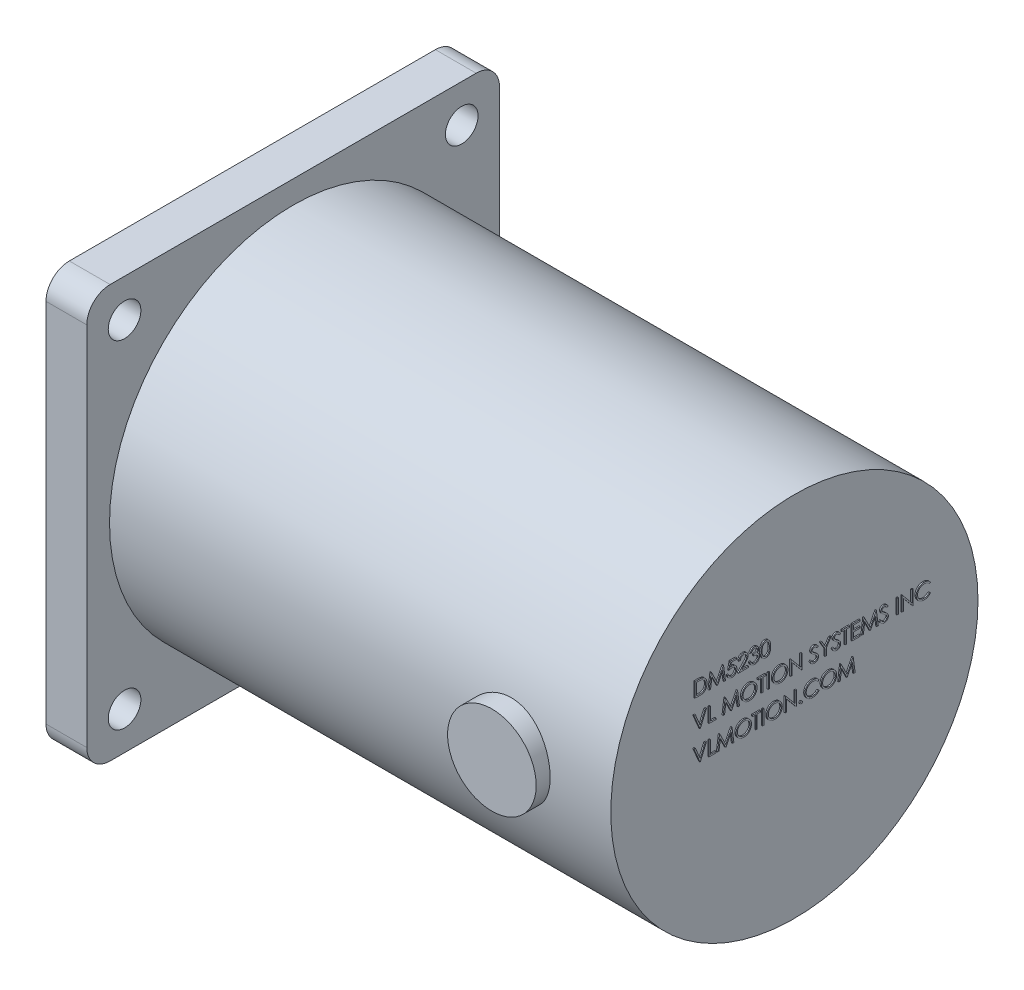
from build123d import *

# Parameters (mm, degrees)
SKETCH1_R           = 40.005
BOSS_EXTRUDE1_DEPTH = 109.22
SKETCH2_W           = 89.916
SKETCH2_H           = 89.916
BOSS_EXTRUDE2_DEPTH = 8.89
FILLET1_R           = 5.08
SKETCH3_R           = 41.529
BOSS_EXTRUDE3_DEPTH = 2
CUT_EXTRUDE4_REACH  = 136.136
SKETCH4_R           = 3.556
CIRPATTERN1_COUNT   = 4
SKETCH6_R           = 5
BOSS_EXTRUDE4_DEPTH = 29.5
BOSS_EXTRUDE5_DEPTH = 4
SKETCH8_R           = 9.652
BOSS_EXTRUDE6_DEPTH = 3.048
SKETCH10_W          = 0.284935897
SKETCH10_H          = 3.175
SKETCH10_W_2        = 0.284935898
BOSS_EXTRUDE7_DEPTH = 0.254


with BuildPart() as part:
    # Sketch1 → Boss-Extrude1 (new body)
    with BuildSketch(Plane(origin=(0, 0, 0), x_dir=(0, 0, -1), z_dir=(1, 0, 0))):
        Circle(SKETCH1_R)
    extrude(amount=-BOSS_EXTRUDE1_DEPTH)

    # Sketch2 → Boss-Extrude2 (add)
    with BuildSketch(Plane.ZY.offset(109.22)):
        Rectangle(SKETCH2_W, SKETCH2_H)
    extrude(amount=BOSS_EXTRUDE2_DEPTH)

    # Fillet1
    fillet1_edges = [part.edges().sort_by_distance(p)[0] for p in [
        (-113.665, -44.958, 44.958),
        (-113.665, 44.958, 44.958),
        (-113.665, 44.958, -44.958),
        (-113.665, -44.958, -44.958),
    ]]
    fillet(fillet1_edges, radius=FILLET1_R)

    # Sketch3 → Boss-Extrude3 (add)
    with BuildSketch(Plane.ZY.offset(118.11)):
        Circle(SKETCH3_R)
    extrude(amount=BOSS_EXTRUDE3_DEPTH)

    # Sketch4 → Cut-Extrude4 (cut, up to next)
    with BuildSketch(Plane.ZY.offset(118.11), mode=Mode.PRIVATE) as cut_extrude4_sk1:
        with Locations((36.729247535, 36.729247535)):
            Circle(SKETCH4_R)
    cut_extrude4_tool1 = extrude(cut_extrude4_sk1.sketch, amount=-CUT_EXTRUDE4_REACH, mode=Mode.PRIVATE) & part.part
    cut_extrude4 = cut_extrude4_tool1.solids().sort_by_distance((-118.11, 36.729248, 36.729248))[0]
    add(cut_extrude4, mode=Mode.SUBTRACT)

    # CirPattern1: Cut-Extrude4 ×4 about axis
    cirpattern1_axis = Axis((0, 0, 0), (1, 0, 0))
    for i in range(1, CIRPATTERN1_COUNT):
        add(cut_extrude4.rotate(cirpattern1_axis, i * 360 / CIRPATTERN1_COUNT), mode=Mode.SUBTRACT)

    # Sketch6 → Boss-Extrude4 (add)
    with BuildSketch(Plane.ZY.offset(120.11)):
        with Locations(Location((0, 0, 0), (0, 0, 180))):
            Circle(SKETCH6_R)
    extrude(amount=BOSS_EXTRUDE4_DEPTH)

    # Sketch7 → Boss-Extrude5 (add)
    with BuildSketch(Plane(origin=(0, 2.660396, 0), x_dir=(1, 0, 0), z_dir=(0, 1, 0))):
        with BuildLine():
            Line((-149.61, 2.03121056), (-128.012686032, 2.03121056))
            ThreePointArc((-128.012686032, 2.03121056), (-125.99620241, 0.252281043), (-127.512, -1.96878944))
            Line((-127.512, -1.96878944), (-149.61, -1.96878944))
            Line((-149.61, -1.96878944), (-149.61, 2.03121056))
        make_face()
    extrude(amount=BOSS_EXTRUDE5_DEPTH)

    # Sketch8 → Boss-Extrude6 (add, symmetric)
    with BuildSketch(Plane.XY.offset(40.005)):
        with Locations((-22.86, 0)):
            Circle(SKETCH8_R)
    boss_extrude6 = extrude(amount=BOSS_EXTRUDE6_DEPTH, both=True)

    # Mirror1: Boss-Extrude6 across plane
    add(boss_extrude6.mirror(Plane.XY))

    # Sketch10 → Boss-Extrude7 (add)
    # profile 1 of 36: a face of its own
    with BuildSketch(Plane(origin=(0, 0, 0), x_dir=(0, 0, -1), z_dir=(1, 0, 0))):
        with BuildLine():
            Line((-21.9069038, 12.614835888), (-21.9069038, 15.789835888))
            Line((-21.9069038, 15.789835888), (-21.26579803, 15.789835888))
            add(Edge.make_bspline(
                [(-21.26579803, 15.789835888), (-21.210036877, 15.789434414), (-21.102306618, 15.788658768), (-20.946629612, 15.783740792), (-20.802590056, 15.775040869), (-20.670661677, 15.762368513), (-20.550482292, 15.746808261), (-20.442388412, 15.727304323), (-20.345821111, 15.704273626), (-20.286430975, 15.68463811), (-20.258346107, 15.675352715)],
                knots=[0, 0, 0, 0, 1.314313732, 2.53924729, 3.670748893, 4.714932338, 5.66265055, 6.526160246, 7.303039223, 8, 8, 8, 8], degree=3))
            add(Edge.make_bspline(
                [(-20.258346107, 15.675352715), (-20.221611594, 15.661354861), (-20.148975584, 15.633676577), (-20.045554837, 15.581464789), (-19.9481954, 15.52230719), (-19.856375176, 15.4561258), (-19.772191569, 15.381046713), (-19.692355834, 15.300259213), (-19.620133906, 15.210825505), (-19.553995666, 15.114600337), (-19.494364032, 15.012717261), (-19.442530653, 14.905370413), (-19.399483102, 14.793104945), (-19.363747818, 14.676233061), (-19.335584246, 14.554497775), (-19.316369208, 14.42775734), (-19.303695524, 14.296512647), (-19.302421849, 14.207454383), (-19.301775594, 14.162266778)],
                knots=[0, 0, 0, 0, 0.984719456, 1.947108742, 2.898477687, 3.838006223, 4.779231079, 5.722358779, 6.681677486, 7.655904652, 8.64651281, 9.637519902, 10.640069247, 11.656948941, 12.698408672, 13.768548281, 14.867775369, 16, 16, 16, 16], degree=3))
            add(Edge.make_bspline(
                [(-19.301775594, 14.162266778), (-19.302346158, 14.123022654), (-19.303470512, 14.04568801), (-19.313566392, 13.931713769), (-19.328240625, 13.821120744), (-19.35095929, 13.714435573), (-19.378538713, 13.610723547), (-19.413884765, 13.511090011), (-19.454375536, 13.414620984), (-19.501592212, 13.322620845), (-19.553427611, 13.2354595), (-19.609055192, 13.153294556), (-19.668415623, 13.077298462), (-19.732074947, 13.007241079), (-19.799210519, 12.943228018), (-19.870261876, 12.884724547), (-19.945412357, 12.832875387), (-20.02432537, 12.785643081), (-20.109303002, 12.74444033), (-20.201954823, 12.709578821), (-20.302675963, 12.680689392), (-20.411219196, 12.656585793), (-20.527772065, 12.637465669), (-20.652448841, 12.624651013), (-20.785057968, 12.615985138), (-20.876116301, 12.61522641), (-20.922984529, 12.614835888)],
                knots=[0, 0, 0, 0, 1.105936401, 2.179363191, 3.223086493, 4.248585256, 5.251745608, 6.245858792, 7.225916811, 8.198733463, 9.158002045, 10.082870192, 10.993790845, 11.873723703, 12.748670949, 13.606408763, 14.465103618, 15.319838547, 16.196477973, 17.123216899, 18.106603292, 19.147568657, 20.255746949, 21.433717677, 22.679120308, 24, 24, 24, 24], degree=3))
            Line((-20.922984529, 12.614835888), (-21.9069038, 12.614835888))
        make_face()
        with BuildLine():
            Line((-21.621967902, 12.940476914), (-21.257529801, 12.940476914))
            add(Edge.make_bspline(
                [(-21.257529801, 12.940476914), (-21.205161922, 12.940701973), (-21.104439312, 12.941134843), (-20.9596067, 12.944933235), (-20.827273248, 12.95113985), (-20.707420164, 12.959825813), (-20.600115121, 12.971318057), (-20.505133862, 12.984131361), (-20.422787735, 13.000094763), (-20.372958888, 13.014564562), (-20.349932646, 13.021251153)],
                knots=[0, 0, 0, 0, 1.375205317, 2.645023457, 3.804390687, 4.853969522, 5.800190428, 6.637939096, 7.370582563, 8, 8, 8, 8], degree=3))
            add(Edge.make_bspline(
                [(-20.349932646, 13.021251153), (-20.320950917, 13.031457923), (-20.263679688, 13.051627676), (-20.181237561, 13.088419269), (-20.10435085, 13.132000289), (-20.031679612, 13.180443781), (-19.964254718, 13.235458368), (-19.901277127, 13.295847765), (-19.842873635, 13.361919311), (-19.789647656, 13.433591001), (-19.742015123, 13.510416744), (-19.700766222, 13.591641257), (-19.66461519, 13.676374578), (-19.636241038, 13.765917886), (-19.614001901, 13.859470675), (-19.598249648, 13.957039525), (-19.588439148, 14.058606217), (-19.587294835, 14.127687072), (-19.586711492, 14.162902795)],
                knots=[0, 0, 0, 0, 0.998632004, 1.973411704, 2.929992603, 3.868527914, 4.809262121, 5.754881198, 6.702106254, 7.672490631, 8.653608572, 9.636854334, 10.631411391, 11.644891563, 12.686317036, 13.754757253, 14.855430412, 16, 16, 16, 16], degree=3))
            add(Edge.make_bspline(
                [(-19.586711492, 14.162902795), (-19.587177117, 14.20003531), (-19.588091841, 14.272982463), (-19.599589251, 14.380016879), (-19.616390948, 14.482960041), (-19.640687578, 14.581818832), (-19.671649161, 14.676786123), (-19.710288586, 14.767336679), (-19.754436162, 14.85442681), (-19.80696276, 14.936046413), (-19.864489763, 15.013238019), (-19.928332553, 15.083954264), (-19.997476831, 15.148356236), (-20.071168444, 15.207446898), (-20.151484242, 15.258848947), (-20.236532232, 15.304829008), (-20.327560091, 15.343850567), (-20.39089018, 15.364604964), (-20.423074673, 15.375152395)],
                knots=[0, 0, 0, 0, 1.122418816, 2.205001699, 3.251619955, 4.274784885, 5.280384055, 6.268708349, 7.249350384, 8.229342522, 9.199999885, 10.157847722, 11.105861043, 12.055065948, 13.010012805, 13.98527497, 14.976112212, 16, 16, 16, 16], degree=3))
            add(Edge.make_bspline(
                [(-20.423074673, 15.375152395), (-20.449700356, 15.382515154), (-20.506313863, 15.398170401), (-20.598696805, 15.415247703), (-20.702669119, 15.430310356), (-20.818692419, 15.443063006), (-20.94663445, 15.452213648), (-21.08659361, 15.459081912), (-21.238630394, 15.463714357), (-21.34402455, 15.464030684), (-21.398725715, 15.464194863)],
                knots=[0, 0, 0, 0, 0.674548936, 1.434276114, 2.292660221, 3.240891867, 4.284742987, 5.42552168, 6.663806718, 8, 8, 8, 8], degree=3))
            Line((-21.398725715, 15.464194863), (-21.621967902, 15.464194863))
            Line((-21.621967902, 15.464194863), (-21.621967902, 12.940476914))
        make_face(mode=Mode.SUBTRACT)
    # profile 2 of 36: a face of its own
    with BuildSketch(Plane(origin=(0, 0, 0), x_dir=(0, 0, -1), z_dir=(1, 0, 0))):
        Polygon((-18.813314056, 12.614835888), (-18.394178439, 15.789835888), (-18.353473311, 15.789835888), (-17.042640979, 13.184707683), (-15.734988735, 15.789835888), (-15.69364759, 15.789835888), (-15.271967902, 12.614835888), (-15.558175835, 12.614835888), (-15.862192261, 14.899411209), (-17.008296027, 12.614835888), (-17.072533808, 12.614835888), (-18.223089697, 14.90449935), (-18.526470106, 12.614835888), align=None)
    # profile 3 of 36: a face of its own
    with BuildSketch(Plane(origin=(0, 0, 0), x_dir=(0, 0, -1), z_dir=(1, 0, 0))):
        with BuildLine():
            Line((-12.911070466, 15.789835888), (-12.911070466, 15.464194863))
            Line((-12.911070466, 15.464194863), (-13.991028399, 15.464194863))
            Line((-13.991028399, 15.464194863), (-14.162117141, 14.629103717))
            add(Edge.make_bspline(
                [(-14.162117141, 14.629103717), (-14.128502169, 14.638384035), (-14.063378478, 14.656363183), (-13.967257747, 14.676325561), (-13.876006248, 14.688359213), (-13.816792162, 14.690002331), (-13.788138776, 14.690797427)],
                knots=[0, 0, 0, 0, 1.100273476, 2.13160584, 3.095893838, 4, 4, 4, 4], degree=3))
            add(Edge.make_bspline(
                [(-13.788138776, 14.690797427), (-13.75268424, 14.690030042), (-13.682971765, 14.688521173), (-13.580973578, 14.674032423), (-13.48360731, 14.651226929), (-13.391076589, 14.619367599), (-13.303210232, 14.578628055), (-13.220816659, 14.527737395), (-13.142659123, 14.468289302), (-13.07013977, 14.399940612), (-13.004349862, 14.32471886), (-12.946505, 14.243839934), (-12.897371793, 14.158089841), (-12.857855965, 14.066649288), (-12.826301605, 13.970529199), (-12.805299438, 13.868718214), (-12.791314281, 13.762175991), (-12.78975183, 13.689328273), (-12.788955082, 13.65218064)],
                knots=[0, 0, 0, 0, 1.052922333, 2.070308379, 3.05430497, 4.020497103, 4.973039431, 5.925935799, 6.892292201, 7.88610001, 8.88166317, 9.857072816, 10.836096531, 11.812156883, 12.81219415, 13.836441305, 14.89672472, 16, 16, 16, 16], degree=3))
            add(Edge.make_bspline(
                [(-12.788955082, 13.65218064), (-12.7895584, 13.626306911), (-12.790756883, 13.574909116), (-12.796851602, 13.498578305), (-12.808586144, 13.423863449), (-12.824341151, 13.350754637), (-12.844790345, 13.279390278), (-12.869545415, 13.209566106), (-12.899840383, 13.141716713), (-12.933070273, 13.075200104), (-12.970486721, 13.01152003), (-13.012014367, 12.951967021), (-13.055888777, 12.895647708), (-13.103097748, 12.843166107), (-13.154080079, 12.794867084), (-13.208218335, 12.750464), (-13.265080516, 12.709205936), (-13.325546343, 12.672767645), (-13.388268452, 12.639236963), (-13.454152621, 12.611729183), (-13.521699113, 12.587136061), (-13.591880108, 12.567533132), (-13.664536638, 12.552172887), (-13.73978847, 12.541740199), (-13.817240935, 12.534141573), (-13.869741839, 12.533665907), (-13.896261772, 12.533425632)],
                knots=[0, 0, 0, 0, 1.056347294, 2.098418968, 3.122841568, 4.141288669, 5.149314143, 6.15115421, 7.162517403, 8.180376062, 9.185164535, 10.17417709, 11.141909838, 12.097768115, 13.052685741, 14.0056014, 14.954263652, 15.917497458, 16.885230207, 17.854509472, 18.828990115, 19.81800267, 20.826176721, 21.857883937, 22.917946725, 24, 24, 24, 24], degree=3))
            add(Edge.make_bspline(
                [(-13.896261772, 12.533425632), (-13.927897636, 12.534052321), (-13.990137461, 12.535285257), (-14.081323976, 12.548183454), (-14.169057939, 12.566656435), (-14.252633103, 12.594447909), (-14.332798463, 12.629270669), (-14.408474786, 12.673281767), (-14.48159574, 12.723155669), (-14.549188802, 12.782011417), (-14.611923276, 12.846342072), (-14.668081323, 12.916153646), (-14.718095354, 12.990293926), (-14.761164453, 13.069122966), (-14.797901944, 13.152433633), (-14.826762683, 13.240538069), (-14.850056619, 13.33297593), (-14.859911293, 13.396615186), (-14.86491662, 13.428938452)],
                knots=[0, 0, 0, 0, 1.0467383, 2.05933395, 3.04377827, 4.011590433, 4.970194871, 5.932262533, 6.905835911, 7.896367577, 8.894135286, 9.877477877, 10.858688626, 11.851381753, 12.8477658, 13.868841284, 14.917554742, 16, 16, 16, 16], degree=3))
            Line((-14.86491662, 13.428938452), (-14.579980723, 13.428938452))
            add(Edge.make_bspline(
                [(-14.579980723, 13.428938452), (-14.572969817, 13.398661242), (-14.559494467, 13.340466762), (-14.529916395, 13.25870476), (-14.493752351, 13.18584375), (-14.450749835, 13.120919914), (-14.399450879, 13.064306037), (-14.340913468, 13.013853417), (-14.275283748, 12.968337407), (-14.202355604, 12.930398182), (-14.125418025, 12.898041527), (-14.044893484, 12.876495347), (-13.962974541, 12.861345251), (-13.907567734, 12.859828725), (-13.879725314, 12.859066658)],
                knots=[0, 0, 0, 0, 1.136247022, 2.183929868, 3.172523383, 4.106158343, 5.02341133, 5.958108904, 6.928429099, 7.938127109, 8.96079061, 9.975095812, 10.982467395, 12, 12, 12, 12], degree=3))
            add(Edge.make_bspline(
                [(-13.879725314, 12.859066658), (-13.852548725, 12.85981122), (-13.799037799, 12.861277271), (-13.72028747, 12.872561232), (-13.64425722, 12.889939886), (-13.57169726, 12.91594754), (-13.501337864, 12.947556677), (-13.434958801, 12.988119639), (-13.370639762, 13.034801227), (-13.310379955, 13.088283313), (-13.255189883, 13.147220107), (-13.206425402, 13.210246028), (-13.165806345, 13.277480596), (-13.131576118, 13.347759813), (-13.105583482, 13.421853933), (-13.087040592, 13.499415714), (-13.076152103, 13.580636731), (-13.074654247, 13.636035319), (-13.073890979, 13.664264975)],
                knots=[0, 0, 0, 0, 1.027316725, 2.022795036, 3.002884548, 3.971462791, 4.93288096, 5.914575861, 6.907176829, 7.935150275, 8.956128384, 9.956726525, 10.942570165, 11.921478529, 12.907843606, 13.90538589, 14.932640048, 16, 16, 16, 16], degree=3))
            add(Edge.make_bspline(
                [(-13.073890979, 13.664264975), (-13.074488314, 13.689733692), (-13.075657512, 13.739585083), (-13.085210244, 13.812518649), (-13.101826354, 13.881527766), (-13.124889445, 13.946945678), (-13.15417157, 14.008834087), (-13.189955011, 14.067256863), (-13.232911308, 14.121443983), (-13.281980378, 14.171420799), (-13.335735886, 14.217544364), (-13.39510271, 14.256863643), (-13.458838501, 14.289941625), (-13.526175352, 14.318487595), (-13.598714938, 14.3389897), (-13.675020741, 14.354381996), (-13.755916754, 14.363285932), (-13.811225878, 14.364521359), (-13.839656203, 14.365156401)],
                knots=[0, 0, 0, 0, 1.045622112, 2.046656509, 3.013763289, 3.955457236, 4.890082067, 5.820317437, 6.762574623, 7.722996705, 8.69280354, 9.665887285, 10.63943826, 11.638615906, 12.663482002, 13.728887084, 14.832589034, 16, 16, 16, 16], degree=3))
            add(Edge.make_bspline(
                [(-13.839656203, 14.365156401), (-13.864266017, 14.364629722), (-13.91507904, 14.363542263), (-13.993023318, 14.35553537), (-14.07493081, 14.342618295), (-14.160487531, 14.324850771), (-14.24995042, 14.301599723), (-14.343130684, 14.273737283), (-14.44022424, 14.240425184), (-14.505645318, 14.215268104), (-14.539275594, 14.202335888)],
                knots=[0, 0, 0, 0, 0.817624296, 1.688186739, 2.600797293, 3.572016777, 4.590301741, 5.671205678, 6.80286297, 8, 8, 8, 8], degree=3))
            Line((-14.539275594, 14.202335888), (-14.213634569, 15.789835888))
            Line((-14.213634569, 15.789835888), (-12.911070466, 15.789835888))
        make_face()
    # profile 4 of 36: a face of its own
    with BuildSketch(Plane(origin=(0, 0, 0), x_dir=(0, 0, -1), z_dir=(1, 0, 0))):
        with BuildLine():
            Line((-12.056262774, 14.812912811), (-12.341198671, 14.812912811))
            add(Edge.make_bspline(
                [(-12.341198671, 14.812912811), (-12.339341611, 14.85071426), (-12.335694394, 14.924955298), (-12.318614446, 15.033199127), (-12.294175222, 15.136663123), (-12.259620831, 15.234516545), (-12.216707279, 15.327624606), (-12.16524504, 15.415617477), (-12.104290619, 15.498159484), (-12.035160224, 15.574485435), (-11.960077245, 15.644505588), (-11.879063999, 15.704971416), (-11.793933153, 15.756059589), (-11.704942984, 15.798769001), (-11.611089473, 15.83082729), (-11.513224309, 15.854614063), (-11.410917521, 15.868925463), (-11.341212644, 15.870463782), (-11.305761973, 15.871246145)],
                knots=[0, 0, 0, 0, 1.10065271, 2.161652631, 3.183658789, 4.190468796, 5.17591951, 6.163126047, 7.15150782, 8.156236427, 9.156009102, 10.134482811, 11.092018607, 12.041330605, 13.001268258, 13.972401359, 14.968799086, 16, 16, 16, 16], degree=3))
            add(Edge.make_bspline(
                [(-11.305761973, 15.871246145), (-11.270947577, 15.870431116), (-11.202538533, 15.868829615), (-11.102696563, 15.855076395), (-11.007648588, 15.833535752), (-10.9175804, 15.80331391), (-10.833210613, 15.762688036), (-10.753905422, 15.713885983), (-10.678720687, 15.657443708), (-10.611041676, 15.590992034), (-10.548895061, 15.5200513), (-10.495280873, 15.444315844), (-10.449367503, 15.366093563), (-10.411097251, 15.284787981), (-10.382924896, 15.199633548), (-10.361536093, 15.111870014), (-10.349446225, 15.020588935), (-10.347590734, 14.95880656), (-10.346647389, 14.927395984)],
                knots=[0, 0, 0, 0, 1.111607364, 2.184268762, 3.212621178, 4.221274766, 5.211760367, 6.196651075, 7.1921475, 8.207485113, 9.220403448, 10.201281604, 11.166441695, 12.114753415, 13.065576456, 14.026450734, 14.996634279, 16, 16, 16, 16], degree=3))
            add(Edge.make_bspline(
                [(-10.346647389, 14.927395984), (-10.348183421, 14.883174734), (-10.351228528, 14.795508255), (-10.37727657, 14.666680487), (-10.417958762, 14.541863599), (-10.466942078, 14.441409047), (-10.516356367, 14.36046152), (-10.560885749, 14.293814909), (-10.613014542, 14.222054949), (-10.673501465, 14.145421936), (-10.741095285, 14.063315614), (-10.816408247, 13.975785586), (-10.899977406, 13.883736195), (-10.958631903, 13.820866113), (-10.989025194, 13.788288412)],
                knots=[0, 0, 0, 0, 1.184426356, 2.348067706, 3.509069118, 4.696110526, 5.333549288, 6.050745305, 6.844228056, 7.710549037, 8.667450064, 9.695053472, 10.805634456, 12, 12, 12, 12], degree=3))
            Line((-10.989025194, 13.788288412), (-11.783411211, 12.940476914))
            Line((-11.783411211, 12.940476914), (-10.305942261, 12.940476914))
            Line((-10.305942261, 12.940476914), (-10.305942261, 12.614835888))
            Line((-10.305942261, 12.614835888), (-12.463314056, 12.614835888))
            Line((-12.463314056, 12.614835888), (-11.231983928, 13.928848308))
            add(Edge.make_bspline(
                [(-11.231983928, 13.928848308), (-11.202004773, 13.960143201), (-11.144420953, 14.020254284), (-11.06297533, 14.108013969), (-10.989824247, 14.189429624), (-10.924494184, 14.264347422), (-10.868402361, 14.333863201), (-10.818625408, 14.395725539), (-10.778742336, 14.452652791), (-10.735457656, 14.518638919), (-10.693534973, 14.599204378), (-10.657510193, 14.697659939), (-10.635543866, 14.799012518), (-10.632908765, 14.867503652), (-10.631583287, 14.901955279)],
                knots=[0, 0, 0, 0, 1.329631726, 2.553950428, 3.673215718, 4.687767853, 5.603093632, 6.413772471, 7.123043292, 7.734684054, 8.834405432, 9.900288307, 10.943827018, 12, 12, 12, 12], degree=3))
            add(Edge.make_bspline(
                [(-10.631583287, 14.901955279), (-10.632159996, 14.923619119), (-10.633296579, 14.966314388), (-10.64332749, 15.028912469), (-10.658486306, 15.089296265), (-10.680208076, 15.147651512), (-10.708879905, 15.203391496), (-10.743780756, 15.256584068), (-10.784048885, 15.308009058), (-10.830631822, 15.356226692), (-10.88180513, 15.4003875), (-10.935865628, 15.439507206), (-10.993061079, 15.472199828), (-11.053150333, 15.499), (-11.115965866, 15.520023382), (-11.18162917, 15.534590808), (-11.249958814, 15.543737061), (-11.296616342, 15.54497456), (-11.320390378, 15.545605119)],
                knots=[0, 0, 0, 0, 0.991446411, 1.95395049, 2.89581595, 3.838931463, 4.798493298, 5.75982156, 6.748411868, 7.785213223, 8.824556874, 9.840280684, 10.836137867, 11.835679398, 12.848801643, 13.863922112, 14.911575587, 16, 16, 16, 16], degree=3))
            add(Edge.make_bspline(
                [(-11.320390378, 15.545605119), (-11.345219634, 15.544956483), (-11.393980192, 15.543682668), (-11.465571029, 15.534772108), (-11.533865984, 15.51939981), (-11.599036853, 15.498375256), (-11.661193906, 15.471652144), (-11.72003486, 15.438367489), (-11.775427624, 15.398649606), (-11.827476327, 15.35361853), (-11.875431508, 15.303482921), (-11.91756546, 15.247593883), (-11.954380958, 15.18697187), (-11.986502192, 15.121780456), (-12.012587711, 15.051428099), (-12.032520497, 14.976164538), (-12.048292851, 14.896316571), (-12.053562009, 14.841175815), (-12.056262774, 14.812912811)],
                knots=[0, 0, 0, 0, 1.031018746, 2.02475058, 2.990194455, 3.934040569, 4.864654155, 5.795059489, 6.735614925, 7.690564532, 8.649604399, 9.611025574, 10.590972636, 11.591080095, 12.624614302, 13.701020113, 14.821632451, 16, 16, 16, 16], degree=3))
        make_face()
    # profile 5 of 36: a face of its own
    with BuildSketch(Plane(origin=(0, 0, 0), x_dir=(0, 0, -1), z_dir=(1, 0, 0))):
        with BuildLine():
            Line((-9.613955082, 15.057143581), (-9.898890979, 15.057143581))
            add(Edge.make_bspline(
                [(-9.898890979, 15.057143581), (-9.891171601, 15.089104477), (-9.876080848, 15.151585415), (-9.844605192, 15.240854858), (-9.810315868, 15.325331196), (-9.769141466, 15.403432634), (-9.724229953, 15.476728781), (-9.672774341, 15.543557201), (-9.617148593, 15.605617534), (-9.555621675, 15.660693114), (-9.491097817, 15.710565769), (-9.422667841, 15.753088142), (-9.351708502, 15.789667909), (-9.27772816, 15.819803405), (-9.200506561, 15.84250513), (-9.120741831, 15.858975947), (-9.038224942, 15.869672172), (-8.982211056, 15.870716078), (-8.953768784, 15.871246145)],
                knots=[0, 0, 0, 0, 1.162005537, 2.271625781, 3.343758855, 4.383309926, 5.390229558, 6.379919256, 7.361854164, 8.333198761, 9.295911338, 10.242430842, 11.177959212, 12.116337295, 13.062827104, 14.020064771, 14.994644689, 16, 16, 16, 16], degree=3))
            add(Edge.make_bspline(
                [(-8.953768784, 15.871246145), (-8.91232801, 15.869994986), (-8.830350408, 15.867519959), (-8.709915358, 15.844919006), (-8.593776743, 15.809154779), (-8.483205783, 15.759739327), (-8.38050049, 15.698790835), (-8.289118378, 15.626251396), (-8.210298086, 15.543520601), (-8.144172472, 15.452141774), (-8.092397294, 15.354482848), (-8.054218941, 15.253971277), (-8.030976416, 15.150845489), (-8.027964197, 15.081215671), (-8.026455082, 15.046331281)],
                knots=[0, 0, 0, 0, 1.083050992, 2.142477498, 3.193116406, 4.255571735, 5.30263384, 6.308962982, 7.297363603, 8.282367274, 9.249857812, 10.179914175, 11.08814088, 12, 12, 12, 12], degree=3))
            add(Edge.make_bspline(
                [(-8.026455082, 15.046331281), (-8.027510625, 15.012760831), (-8.029576159, 14.947068671), (-8.047114592, 14.85116417), (-8.076629631, 14.760775004), (-8.117514344, 14.675520664), (-8.170438464, 14.595941703), (-8.234548697, 14.521859073), (-8.31029754, 14.452944194), (-8.367700576, 14.413465815), (-8.397253359, 14.393141177)],
                knots=[0, 0, 0, 0, 1.024540389, 2.004866551, 2.965041327, 3.920577974, 4.882998113, 5.874504559, 6.905732034, 8, 8, 8, 8], degree=3))
            add(Edge.make_bspline(
                [(-8.397253359, 14.393141177), (-8.363478839, 14.376832407), (-8.296561746, 14.344520017), (-8.205348051, 14.281150865), (-8.122545978, 14.207984036), (-8.076369033, 14.150886058), (-8.053167822, 14.122197667)],
                knots=[0, 0, 0, 0, 1.015518401, 2.012035669, 3.001164323, 4, 4, 4, 4], degree=3))
            add(Edge.make_bspline(
                [(-8.053167822, 14.122197667), (-8.037890319, 14.101280992), (-8.007585491, 14.059790168), (-7.970178972, 13.993082125), (-7.936243561, 13.925634702), (-7.909800147, 13.855640098), (-7.889322425, 13.783909579), (-7.874684739, 13.710319976), (-7.865591411, 13.634811199), (-7.86428916, 13.583727735), (-7.863634569, 13.558050031)],
                knots=[0, 0, 0, 0, 1.025084078, 2.033381695, 3.024893161, 4.013698104, 4.991890475, 5.976764909, 6.982997093, 8, 8, 8, 8], degree=3))
            add(Edge.make_bspline(
                [(-7.863634569, 13.558050031), (-7.865262449, 13.513591212), (-7.868510548, 13.424882799), (-7.897542816, 13.293823588), (-7.942549113, 13.165711882), (-8.006463619, 13.043179706), (-8.084357716, 12.928534646), (-8.177029003, 12.82595828), (-8.283424531, 12.737785261), (-8.402083941, 12.664115982), (-8.530641622, 12.605226153), (-8.668142337, 12.564352616), (-8.812604886, 12.537731602), (-8.911671506, 12.534876942), (-8.962037013, 12.533425632)],
                knots=[0, 0, 0, 0, 0.955779014, 1.907060117, 2.875433937, 3.871313158, 4.872415639, 5.851225146, 6.836215519, 7.83643374, 8.849228613, 9.86973379, 10.916971861, 12, 12, 12, 12], degree=3))
            add(Edge.make_bspline(
                [(-8.962037013, 12.533425632), (-8.995981664, 12.534213225), (-9.062773418, 12.535762947), (-9.160965734, 12.546357106), (-9.254693276, 12.565706468), (-9.344082768, 12.591744467), (-9.429213622, 12.624756975), (-9.509826061, 12.665867509), (-9.586416035, 12.714228657), (-9.658260798, 12.770411269), (-9.725351785, 12.833259341), (-9.785906042, 12.903888586), (-9.840933139, 12.980993374), (-9.888959676, 13.065469289), (-9.932173197, 13.15622463), (-9.967715922, 13.254421482), (-9.99899926, 13.359181987), (-10.013543902, 13.432186795), (-10.021006364, 13.469643581)],
                knots=[0, 0, 0, 0, 1.048658725, 2.063410685, 3.046034179, 4.001477787, 4.936774919, 5.862367409, 6.792675028, 7.730719943, 8.675894397, 9.627829632, 10.600096036, 11.597688215, 12.626045268, 13.701542398, 14.82072376, 16, 16, 16, 16], degree=3))
            Line((-10.021006364, 13.469643581), (-9.736070466, 13.469643581))
            add(Edge.make_bspline(
                [(-9.736070466, 13.469643581), (-9.728647052, 13.445196976), (-9.714207866, 13.397646206), (-9.689629467, 13.329211071), (-9.661627535, 13.266474837), (-9.631587899, 13.208977291), (-9.60003888, 13.156152183), (-9.564737484, 13.109396345), (-9.528298331, 13.066656125), (-9.500830632, 13.04257637), (-9.487387574, 13.030791417)],
                knots=[0, 0, 0, 0, 1.198163088, 2.33053128, 3.407730985, 4.417276592, 5.372219308, 6.28897303, 7.162600585, 8, 8, 8, 8], degree=3))
            add(Edge.make_bspline(
                [(-9.487387574, 13.030791417), (-9.469610679, 13.017086), (-9.434111764, 12.989717471), (-9.376264868, 12.954790994), (-9.315427436, 12.924527778), (-9.250281267, 12.901410425), (-9.182232154, 12.881836405), (-9.110180187, 12.869027076), (-9.03476104, 12.860238521), (-8.983264569, 12.859462976), (-8.956948872, 12.859066658)],
                knots=[0, 0, 0, 0, 0.946170439, 1.889420265, 2.845303464, 3.807233317, 4.801018734, 5.828864929, 6.890507805, 8, 8, 8, 8], degree=3))
            add(Edge.make_bspline(
                [(-8.956948872, 12.859066658), (-8.927236766, 12.859625372), (-8.869137307, 12.860717889), (-8.784360399, 12.870765137), (-8.703708643, 12.885397726), (-8.628077489, 12.907997361), (-8.556476243, 12.93591999), (-8.489908604, 12.970979615), (-8.427500708, 13.012113756), (-8.37005189, 13.058867135), (-8.318394179, 13.110049491), (-8.272910478, 13.163582777), (-8.234243821, 13.21924128), (-8.203053004, 13.277333004), (-8.178423576, 13.33761739), (-8.161656672, 13.400263614), (-8.149998512, 13.464758991), (-8.149049086, 13.50860027), (-8.148570466, 13.530701273)],
                knots=[0, 0, 0, 0, 1.217147791, 2.380027433, 3.494444702, 4.572153297, 5.609568379, 6.639424714, 7.649109417, 8.668170816, 9.669597737, 10.625200337, 11.543417969, 12.441394052, 13.322311151, 14.205496177, 15.095365482, 16, 16, 16, 16], degree=3))
            add(Edge.make_bspline(
                [(-8.148570466, 13.530701273), (-8.149958668, 13.560284416), (-8.152728165, 13.619303501), (-8.173872376, 13.706133014), (-8.208651203, 13.789792824), (-8.257339838, 13.868855577), (-8.316608678, 13.942130859), (-8.385882558, 14.007509989), (-8.465736736, 14.061457858), (-8.539233332, 14.098731139), (-8.604334581, 14.124164771), (-8.660047108, 14.141105632), (-8.72241917, 14.155450877), (-8.790696501, 14.168797009), (-8.865393561, 14.18015566), (-8.94642903, 14.189627879), (-9.033819328, 14.197207095), (-9.094317743, 14.200591731), (-9.125493543, 14.202335888)],
                knots=[0, 0, 0, 0, 1.07054697, 2.135767047, 3.216561865, 4.33974944, 5.486079747, 6.621378074, 7.775625952, 8.963672916, 9.598146892, 10.304877434, 11.070270905, 11.915000392, 12.823868403, 13.805723172, 14.86925407, 16, 16, 16, 16], degree=3))
            Line((-9.125493543, 14.202335888), (-9.125493543, 14.527976914))
            add(Edge.make_bspline(
                [(-9.125493543, 14.527976914), (-9.0862132, 14.528643486), (-9.009272657, 14.529949137), (-8.896882823, 14.545740689), (-8.789410605, 14.567585259), (-8.689237774, 14.601045397), (-8.597935013, 14.639907667), (-8.51872366, 14.685130742), (-8.452713462, 14.735399836), (-8.400225204, 14.791490846), (-8.360737975, 14.851648068), (-8.331866523, 14.91434675), (-8.314811942, 14.980136434), (-8.312535315, 15.025035169), (-8.311390979, 15.047603316)],
                knots=[0, 0, 0, 0, 1.321986639, 2.589447074, 3.816329219, 5.01088745, 6.139805852, 7.153945165, 8.075214402, 8.924034688, 9.728124013, 10.488707548, 11.240355623, 12, 12, 12, 12], degree=3))
            add(Edge.make_bspline(
                [(-8.311390979, 15.047603316), (-8.311766909, 15.064183842), (-8.312514804, 15.097170012), (-8.32194662, 15.145362039), (-8.336119857, 15.192080754), (-8.35560504, 15.237127482), (-8.381685578, 15.280189802), (-8.412896723, 15.321634845), (-8.450060642, 15.361225987), (-8.492646869, 15.398128848), (-8.538377578, 15.433298085), (-8.588497017, 15.463155456), (-8.641494003, 15.488687048), (-8.697427211, 15.509741382), (-8.756478157, 15.52557945), (-8.818369391, 15.536951249), (-8.883218933, 15.544061122), (-8.927461861, 15.545084756), (-8.949952678, 15.545605119)],
                knots=[0, 0, 0, 0, 0.884392785, 1.759457502, 2.611959086, 3.489218968, 4.37281399, 5.2945488, 6.255912374, 7.266815255, 8.301784654, 9.332968512, 10.37626691, 11.440494194, 12.520033166, 13.637162961, 14.798855837, 16, 16, 16, 16], degree=3))
            add(Edge.make_bspline(
                [(-8.949952678, 15.545605119), (-8.986103834, 15.544342955), (-9.056715449, 15.541877655), (-9.15851041, 15.520284921), (-9.253142948, 15.485833374), (-9.32547731, 15.444709849), (-9.378892217, 15.404114813), (-9.417062011, 15.368661505), (-9.454545617, 15.32926173), (-9.488877052, 15.283488775), (-9.523597017, 15.234442472), (-9.555206012, 15.179629561), (-9.58592159, 15.120479861), (-9.604429617, 15.078664535), (-9.613955082, 15.057143581)],
                knots=[0, 0, 0, 0, 1.472543308, 2.876219568, 4.221790263, 5.565193594, 6.249813518, 6.953379497, 7.687249741, 8.463570142, 9.283606569, 10.136032583, 11.040678096, 12, 12, 12, 12], degree=3))
        make_face()
    # profile 6 of 36: a face of its own
    with BuildSketch(Plane(origin=(0, 0, 0), x_dir=(0, 0, -1), z_dir=(1, 0, 0))):
        with BuildLine():
            add(Edge.make_bspline(
                [(-7.578698671, 14.201063853), (-7.578401112, 14.251952198), (-7.577823099, 14.35080354), (-7.571392888, 14.494843894), (-7.560710971, 14.629972156), (-7.546072068, 14.756194795), (-7.528257615, 14.873544396), (-7.504476423, 14.981707354), (-7.477431952, 15.081184283), (-7.446087948, 15.17229957), (-7.410720454, 15.256280772), (-7.372226517, 15.334680776), (-7.329078454, 15.407380957), (-7.283742254, 15.475541667), (-7.234382732, 15.538047162), (-7.182404543, 15.595780148), (-7.125778984, 15.647406329), (-7.066430969, 15.694438332), (-7.003823177, 15.735667496), (-6.939740187, 15.771982908), (-6.873740912, 15.803007074), (-6.805645161, 15.827400541), (-6.736064983, 15.847548952), (-6.664757144, 15.861327497), (-6.591603907, 15.869996978), (-6.542226819, 15.870825805), (-6.51718525, 15.871246145)],
                knots=[0, 0, 0, 0, 1.646270934, 3.197905019, 4.663502075, 6.030701355, 7.308322542, 8.50163776, 9.611534131, 10.641858119, 11.616356847, 12.558055219, 13.465016945, 14.349605745, 15.204443733, 16.039544428, 16.859896111, 17.680448484, 18.487036065, 19.28249412, 20.06191084, 20.843045899, 21.620316918, 22.403196591, 23.190181807, 24, 24, 24, 24], degree=3))
            add(Edge.make_bspline(
                [(-6.51718525, 15.871246145), (-6.491934494, 15.870803627), (-6.441718686, 15.869923597), (-6.367477774, 15.86146545), (-6.294951992, 15.847430931), (-6.224450537, 15.827545475), (-6.1553943, 15.802875111), (-6.088323416, 15.771953227), (-6.022821277, 15.735958826), (-5.959928802, 15.693664308), (-5.898955544, 15.646508958), (-5.841399178, 15.593202822), (-5.787254464, 15.534284149), (-5.735841865, 15.470383315), (-5.688620002, 15.400274702), (-5.643649817, 15.325177688), (-5.603398042, 15.243778975), (-5.564631587, 15.157436694), (-5.53116982, 15.063761803), (-5.500992583, 14.963282342), (-5.476609519, 14.854811472), (-5.45629925, 14.738918307), (-5.440564952, 14.615177233), (-5.429105341, 14.483853504), (-5.423051899, 14.344860721), (-5.421911892, 14.249830386), (-5.421326876, 14.201063853)],
                knots=[0, 0, 0, 0, 0.810914788, 1.612654377, 2.396697861, 3.181598691, 3.963628158, 4.749916497, 5.551656086, 6.361998678, 7.18212741, 8.025565596, 8.878627764, 9.750805457, 10.657531673, 11.591944965, 12.560506719, 13.57287815, 14.630710178, 15.753379473, 16.941251878, 18.199788006, 19.531962791, 20.947069417, 22.433333509, 24, 24, 24, 24], degree=3))
            add(Edge.make_bspline(
                [(-5.421326876, 14.201063853), (-5.421917957, 14.152510022), (-5.423069653, 14.057904863), (-5.429037479, 13.919537478), (-5.440792809, 13.788910682), (-5.455497584, 13.665711191), (-5.475863815, 13.55045178), (-5.500905644, 13.442733601), (-5.528709866, 13.342091479), (-5.563031429, 13.2493499), (-5.600596859, 13.163215123), (-5.641468358, 13.082781353), (-5.685255986, 13.007337644), (-5.732961491, 12.937487874), (-5.783809944, 12.872737235), (-5.838889653, 12.814228677), (-5.896647969, 12.760552425), (-5.957800661, 12.712789877), (-6.021673996, 12.670984376), (-6.086951159, 12.633597526), (-6.154790371, 12.603450724), (-6.223654264, 12.577565365), (-6.294527853, 12.557789241), (-6.367322793, 12.544115101), (-6.441668807, 12.534524924), (-6.491925941, 12.533793331), (-6.51718525, 12.533425632)],
                knots=[0, 0, 0, 0, 1.561518951, 3.042555995, 4.452378317, 5.7783523, 7.031515105, 8.214008947, 9.334062868, 10.386615937, 11.391082383, 12.354592575, 13.286541444, 14.194233754, 15.072674879, 15.931287219, 16.775624067, 17.606195743, 18.42308326, 19.229000347, 20.022332153, 20.807536673, 21.593273796, 22.3848459, 23.188221202, 24, 24, 24, 24], degree=3))
            add(Edge.make_bspline(
                [(-6.51718525, 12.533425632), (-6.542226125, 12.533848683), (-6.591601842, 12.534682857), (-6.664765114, 12.54331317), (-6.735778473, 12.557188377), (-6.804992343, 12.576616296), (-6.872761824, 12.600396898), (-6.938163456, 12.631379168), (-7.001924426, 12.667060788), (-7.063874623, 12.707696634), (-7.122849941, 12.754252733), (-7.179182247, 12.805746052), (-7.231456372, 12.863461575), (-7.280110158, 12.926487976), (-7.326350938, 12.994245418), (-7.368886298, 13.067659013), (-7.408229859, 13.146437667), (-7.444192168, 13.231090343), (-7.476077027, 13.322852313), (-7.504241734, 13.422773354), (-7.526479577, 13.531735395), (-7.545514115, 13.648863293), (-7.560866948, 13.774660358), (-7.571348372, 13.909194885), (-7.577826565, 14.052383039), (-7.578402664, 14.150599192), (-7.578698671, 14.201063853)],
                knots=[0, 0, 0, 0, 0.810891512, 1.598919785, 2.382837074, 3.152667961, 3.926044502, 4.706494248, 5.493654104, 6.291793342, 7.103789334, 7.925228297, 8.761435821, 9.622817696, 10.50288917, 11.416980706, 12.369136599, 13.353924996, 14.394355917, 15.514179734, 16.714354668, 17.994756427, 19.357759367, 20.818452758, 22.365282078, 24, 24, 24, 24], degree=3))
        make_face()
        with BuildLine():
            add(Edge.make_bspline(
                [(-7.293762774, 14.202335888), (-7.293654418, 14.15992814), (-7.293444121, 14.077623028), (-7.287950282, 13.958022356), (-7.280466143, 13.8464707), (-7.270812967, 13.742826421), (-7.256477435, 13.647440338), (-7.240414849, 13.559656411), (-7.220867653, 13.479939203), (-7.19774003, 13.407741689), (-7.17139742, 13.341838606), (-7.142635673, 13.280514646), (-7.111737731, 13.223045389), (-7.077158216, 13.169947045), (-7.039498123, 13.121046453), (-6.999608095, 13.075478098), (-6.955999394, 13.034840836), (-6.895670999, 12.986102904), (-6.816027054, 12.935739118), (-6.715678498, 12.891882308), (-6.612564975, 12.86432108), (-6.542577769, 12.860816101), (-6.507644985, 12.859066658)],
                knots=[0, 0, 0, 0, 1.459021318, 2.831673884, 4.118529203, 5.306027144, 6.411944654, 7.436330062, 8.375795394, 9.233974572, 10.042671642, 10.816086306, 11.563610507, 12.285937304, 12.993564865, 13.685989202, 14.367179055, 15.041617293, 16.353048772, 17.594441528, 18.799311195, 20, 20, 20, 20], degree=3))
            add(Edge.make_bspline(
                [(-6.507644985, 12.859066658), (-6.47248624, 12.860516073), (-6.40224134, 12.863411911), (-6.299612826, 12.891350766), (-6.199981081, 12.933505277), (-6.121901535, 12.983350514), (-6.062499514, 13.030819784), (-6.019939101, 13.071291644), (-5.980875671, 13.116608752), (-5.943826075, 13.165503113), (-5.909845342, 13.218908867), (-5.87894521, 13.276569203), (-5.850748173, 13.338644243), (-5.834683539, 13.38197822), (-5.826470106, 13.404133765)],
                knots=[0, 0, 0, 0, 1.353760809, 2.704726607, 4.075137775, 5.516104923, 6.260822281, 7.007110065, 7.778089737, 8.566572457, 9.372053459, 10.217411131, 11.088608312, 12, 12, 12, 12], degree=3))
            add(Edge.make_bspline(
                [(-5.826470106, 13.404133765), (-5.816898145, 13.4324636), (-5.797462959, 13.489985315), (-5.772415136, 13.579215199), (-5.752688952, 13.672834849), (-5.734942185, 13.770284777), (-5.722829055, 13.872283648), (-5.713079253, 13.978515868), (-5.707336416, 14.089061532), (-5.706624534, 14.164168417), (-5.706262774, 14.202335888)],
                knots=[0, 0, 0, 0, 0.884706709, 1.796334032, 2.740027952, 3.714592787, 4.726048262, 5.777819803, 6.87074269, 8, 8, 8, 8], degree=3))
            add(Edge.make_bspline(
                [(-5.706262774, 14.202335888), (-5.706761874, 14.240497186), (-5.707738221, 14.315148843), (-5.711470195, 14.42447605), (-5.721107295, 14.528314661), (-5.731810782, 14.627112019), (-5.747592546, 14.720321222), (-5.764608557, 14.80872257), (-5.787469657, 14.891220885), (-5.811889738, 14.969107792), (-5.839839168, 15.041498385), (-5.870605585, 15.108730177), (-5.903463894, 15.171127749), (-5.939152927, 15.228519903), (-5.977249011, 15.28116371), (-6.018757645, 15.328003664), (-6.062032326, 15.370491485), (-6.122645058, 15.418989672), (-6.201996736, 15.468439568), (-6.300735287, 15.513947078), (-6.403487943, 15.540080315), (-6.472951005, 15.543764846), (-6.507644985, 15.545605119)],
                knots=[0, 0, 0, 0, 1.31362396, 2.569729283, 3.763502607, 4.902122613, 5.988968491, 7.01645872, 7.998833611, 8.933434873, 9.825090667, 10.667526885, 11.477055099, 12.250526234, 12.991942729, 13.710640831, 14.402115721, 15.076753259, 16.378508321, 17.609869233, 18.806226677, 20, 20, 20, 20], degree=3))
            add(Edge.make_bspline(
                [(-6.507644985, 15.545605119), (-6.542761023, 15.543762307), (-6.61305707, 15.540073325), (-6.716877714, 15.514044445), (-6.816395233, 15.46867554), (-6.895537075, 15.418825888), (-6.956192081, 15.371347563), (-6.99890281, 15.330175565), (-7.038949695, 15.28513932), (-7.075841109, 15.235789011), (-7.11039353, 15.182752571), (-7.142126305, 15.125612763), (-7.170717026, 15.064080026), (-7.197100855, 14.998206545), (-7.220299027, 14.92601526), (-7.239434265, 14.846396244), (-7.257111806, 14.758891528), (-7.269626086, 14.662988831), (-7.280751064, 14.559318592), (-7.287900573, 14.447488453), (-7.293462499, 14.327687194), (-7.293660678, 14.244956529), (-7.293762774, 14.202335888)],
                knots=[0, 0, 0, 0, 1.207732386, 2.417664972, 3.655092373, 4.956220595, 5.625982001, 6.301752483, 6.994047911, 7.697131622, 8.419323945, 9.170223765, 9.943494443, 10.752040957, 11.610060368, 12.549350801, 13.567764191, 14.679664412, 15.874934091, 17.154273443, 18.533957287, 20, 20, 20, 20], degree=3))
        make_face(mode=Mode.SUBTRACT)
    # profile 7 of 36: a face of its own
    with BuildSketch(Plane(origin=(0, 0, 0), x_dir=(0, 0, -1), z_dir=(1, 0, 0))):
        Polygon((-22.151134569, 9.498169222), (-21.845846107, 9.498169222), (-20.787512774, 6.996075872), (-19.729179441, 9.498169222), (-19.423890979, 9.498169222), (-20.76716021, 6.323169222), (-20.807865338, 6.323169222), align=None)
    # profile 8 of 36: a face of its own
    with BuildSketch(Plane(origin=(0, 0, 0), x_dir=(0, 0, -1), z_dir=(1, 0, 0))):
        Polygon((-18.854019184, 9.498169222), (-18.569083287, 9.498169222), (-18.569083287, 6.648810247), (-17.347929441, 6.648810247), (-17.347929441, 6.323169222), (-18.854019184, 6.323169222), align=None)
    # profile 9 of 36: a face of its own
    with BuildSketch(Plane(origin=(0, 0, 0), x_dir=(0, 0, -1), z_dir=(1, 0, 0))):
        Polygon((-15.760429441, 6.323169222), (-15.341293824, 9.498169222), (-15.300588695, 9.498169222), (-13.989756364, 6.893041016), (-12.68210412, 9.498169222), (-12.640762974, 9.498169222), (-12.219083287, 6.323169222), (-12.505291219, 6.323169222), (-12.809307646, 8.607744542), (-13.955411412, 6.323169222), (-14.019649192, 6.323169222), (-15.170205082, 8.612832683), (-15.47358549, 6.323169222), align=None)
    # profile 10 of 36: a face of its own
    with BuildSketch(Plane(origin=(0, 0, 0), x_dir=(0, 0, -1), z_dir=(1, 0, 0))):
        with BuildLine():
            add(Edge.make_bspline(
                [(-10.082064056, 9.579579478), (-10.023273846, 9.578090422), (-9.907805022, 9.575165792), (-9.738101365, 9.55277832), (-9.5760901, 9.514047502), (-9.420451474, 9.462464653), (-9.273047131, 9.39365389), (-9.132767564, 9.310482362), (-8.999946543, 9.212078717), (-8.87637429, 9.099203633), (-8.763292628, 8.9763915), (-8.663664859, 8.845329396), (-8.58016935, 8.706809768), (-8.511602243, 8.561248872), (-8.457809933, 8.408975901), (-8.420690515, 8.249179055), (-8.396979478, 8.082893701), (-8.394207452, 7.969476473), (-8.392801235, 7.911941257)],
                knots=[0, 0, 0, 0, 1.065120563, 2.091984664, 3.0946048, 4.079830382, 5.057816894, 6.036188127, 7.030412546, 8.04752943, 9.064399622, 10.05169764, 11.02544977, 11.989514704, 12.962713494, 13.945757189, 14.957906945, 16, 16, 16, 16], degree=3))
            add(Edge.make_bspline(
                [(-8.392801235, 7.911941257), (-8.394207246, 7.854829859), (-8.396978655, 7.742256678), (-8.420717474, 7.577026553), (-8.457947524, 7.418194279), (-8.511102709, 7.266025008), (-8.579342964, 7.120358218), (-8.663394441, 6.981577196), (-8.76240111, 6.849636443), (-8.875074468, 6.725981383), (-8.997902556, 6.61259082), (-9.129647156, 6.51378584), (-9.267345381, 6.42876467), (-9.412769188, 6.360925194), (-9.563989936, 6.306703524), (-9.722361043, 6.269735066), (-9.887140417, 6.245888963), (-9.999509114, 6.243150738), (-10.056623351, 6.241758965)],
                knots=[0, 0, 0, 0, 1.043624062, 2.057103931, 3.04512605, 4.022047818, 4.998200453, 5.980619268, 6.982898556, 8.009068085, 9.034988726, 10.034168286, 11.015286542, 11.987931943, 12.962482838, 13.94673481, 14.956375938, 16, 16, 16, 16], degree=3))
            add(Edge.make_bspline(
                [(-10.056623351, 6.241758965), (-10.114158269, 6.24316448), (-10.227574908, 6.245935125), (-10.394069218, 6.269685399), (-10.553978314, 6.306825011), (-10.706844904, 6.359901428), (-10.852754233, 6.428497059), (-10.991991666, 6.512139602), (-11.123998321, 6.611387509), (-11.247679762, 6.72402433), (-11.360845106, 6.846644238), (-11.459505397, 6.978029598), (-11.54316675, 7.115602762), (-11.611532058, 7.259745516), (-11.665656247, 7.409761039), (-11.702581332, 7.566650015), (-11.726471802, 7.729517996), (-11.729224842, 7.840409768), (-11.730621748, 7.896676834)],
                knots=[0, 0, 0, 0, 1.053102029, 2.075944431, 3.073151272, 4.055350789, 5.033113405, 6.020478099, 7.024410459, 8.052272461, 9.079885166, 10.07527673, 11.055994387, 12.023226415, 12.992069828, 13.970394897, 14.97016774, 16, 16, 16, 16], degree=3))
            add(Edge.make_bspline(
                [(-11.730621748, 7.896676834), (-11.730136757, 7.934443612), (-11.729172894, 8.009500724), (-11.717569002, 8.120958283), (-11.700730887, 8.23062338), (-11.676599152, 8.338184168), (-11.64503814, 8.443377347), (-11.607798087, 8.546928396), (-11.562314084, 8.647787917), (-11.510896639, 8.746433708), (-11.453509142, 8.841328023), (-11.390121855, 8.93102593), (-11.322961199, 9.01628012), (-11.249334406, 9.094881331), (-11.17166806, 9.169116148), (-11.088702245, 9.237843755), (-11.000943209, 9.301683889), (-10.908013336, 9.359215199), (-10.812202472, 9.411248128), (-10.713435681, 9.455899379), (-10.613054363, 9.494222592), (-10.510588361, 9.525283912), (-10.406309775, 9.54980583), (-10.299991013, 9.566503929), (-10.191716776, 9.578137418), (-10.118772223, 9.579096723), (-10.082064056, 9.579579478)],
                knots=[0, 0, 0, 0, 1.037015668, 2.060948919, 3.074880161, 4.083647147, 5.086022904, 6.090072063, 7.104153813, 8.122640571, 9.144368836, 10.147691507, 11.138137339, 12.123020368, 13.103399296, 14.087645067, 15.080126199, 16.082011238, 17.087798457, 18.072939717, 19.057185487, 20.037253025, 21.01195951, 21.997135196, 22.992090687, 24, 24, 24, 24], degree=3))
        make_face()
        with BuildLine():
            add(Edge.make_bspline(
                [(-10.068071668, 9.253938452), (-10.098202086, 9.253571159), (-10.158174872, 9.252840084), (-10.247332987, 9.243210113), (-10.335318527, 9.229485143), (-10.422149663, 9.20990762), (-10.507463082, 9.183233944), (-10.59205401, 9.152535406), (-10.675151066, 9.115141988), (-10.756479922, 9.072893892), (-10.835324312, 9.026131656), (-10.909721548, 8.974450125), (-10.979864233, 8.919061293), (-11.045580624, 8.859835898), (-11.106677759, 8.796472331), (-11.164358167, 8.729931192), (-11.216309859, 8.658310548), (-11.263921775, 8.583552536), (-11.306528316, 8.50575453), (-11.344415459, 8.425735584), (-11.375407096, 8.342842968), (-11.400682251, 8.257975982), (-11.42163708, 8.171269037), (-11.434912139, 8.082064374), (-11.444647923, 7.990810237), (-11.445337211, 7.929140983), (-11.445685851, 7.897948869)],
                knots=[0, 0, 0, 0, 1.008559885, 2.007477868, 2.99961109, 3.989939068, 4.984837346, 5.991145699, 7.001802488, 8.033829008, 9.059044045, 10.069351652, 11.065060232, 12.050310815, 13.029377138, 14.011219647, 14.996725999, 15.989392538, 16.977580475, 17.965360261, 18.951710183, 19.937753436, 20.929683414, 21.935841486, 22.955955122, 24, 24, 24, 24], degree=3))
            add(Edge.make_bspline(
                [(-11.445685851, 7.897948869), (-11.444529369, 7.852081712), (-11.442254211, 7.761846823), (-11.422335558, 7.629614293), (-11.391654196, 7.502534205), (-11.346426442, 7.381301901), (-11.289865527, 7.264875302), (-11.219991134, 7.154287235), (-11.137206106, 7.049507814), (-11.043168479, 6.951268534), (-10.940368595, 6.861601269), (-10.831209618, 6.782894462), (-10.716860989, 6.716300878), (-10.597024512, 6.662049134), (-10.472339959, 6.619059872), (-10.342003894, 6.589597114), (-10.206884549, 6.570206522), (-10.11478174, 6.568344379), (-10.068071668, 6.567399991)],
                knots=[0, 0, 0, 0, 1.032063989, 2.030389145, 3.003944642, 3.970395727, 4.937377036, 5.913328081, 6.909231446, 7.93887556, 8.970685674, 9.976071282, 10.964166581, 11.944589148, 12.933237628, 13.927779006, 14.949070134, 16, 16, 16, 16], degree=3))
            add(Edge.make_bspline(
                [(-10.068071668, 6.567399991), (-10.036675906, 6.567831341), (-9.97440868, 6.568686839), (-9.881793456, 6.577303495), (-9.79084675, 6.591120977), (-9.701696125, 6.611015215), (-9.61444276, 6.635913752), (-9.528722474, 6.665493619), (-9.445448311, 6.702397283), (-9.363569744, 6.743171496), (-9.28519601, 6.789653639), (-9.21037892, 6.839581103), (-9.141004281, 6.894888352), (-9.075337052, 6.953233796), (-9.013989077, 7.015793858), (-8.957375213, 7.082487202), (-8.905686093, 7.153734798), (-8.858092257, 7.228379417), (-8.815635011, 7.306390303), (-8.778642543, 7.386699368), (-8.747258923, 7.46910886), (-8.72192378, 7.553737643), (-8.702070539, 7.640424984), (-8.688390898, 7.729286955), (-8.678821957, 7.820145787), (-8.678100708, 7.881599142), (-8.677737133, 7.912577274)],
                knots=[0, 0, 0, 0, 1.047197238, 2.076906641, 3.100256066, 4.114471768, 5.12198147, 6.126382909, 7.136867548, 8.15857795, 9.17633901, 10.174870724, 11.156907918, 12.133735059, 13.104061851, 14.077631395, 15.04955518, 16.038496417, 17.029181396, 18.010275684, 18.986308667, 19.968651475, 20.955262928, 21.950658345, 22.966943676, 24, 24, 24, 24], degree=3))
            add(Edge.make_bspline(
                [(-8.677737133, 7.912577274), (-8.678101, 7.943343482), (-8.678822796, 8.004373922), (-8.688386327, 8.094599093), (-8.702084992, 8.182821649), (-8.721826877, 8.268695242), (-8.747272374, 8.352241761), (-8.778648023, 8.433382739), (-8.815646116, 8.512420459), (-8.858107863, 8.589159571), (-8.905837931, 8.662796655), (-8.957993423, 8.733193129), (-9.015474846, 8.799026973), (-9.076639883, 8.861923445), (-9.143016329, 8.920541102), (-9.21430351, 8.974899389), (-9.289635989, 9.026310145), (-9.369398553, 9.072688333), (-9.451716282, 9.115518387), (-9.536183944, 9.152213226), (-9.621844627, 9.183393648), (-9.708480501, 9.209988324), (-9.796820774, 9.229408465), (-9.886268533, 9.243222482), (-9.976700025, 9.252836732), (-10.037517803, 9.253570047), (-10.068071668, 9.253938452)],
                knots=[0, 0, 0, 0, 1.02996197, 2.043119294, 3.035359645, 4.018872909, 4.991431989, 5.957985074, 6.929999688, 7.912076566, 8.892894881, 9.867085534, 10.843653904, 11.817741046, 12.803660682, 13.806313499, 14.818574707, 15.856120519, 16.894564902, 17.924820532, 18.937903209, 19.946497019, 20.957711757, 21.963978472, 22.977135795, 24, 24, 24, 24], degree=3))
        make_face(mode=Mode.SUBTRACT)
    # profile 11 of 36: a face of its own
    with BuildSketch(Plane(origin=(0, 0, 0), x_dir=(0, 0, -1), z_dir=(1, 0, 0))):
        Polygon((-8.107865338, 9.172528196), (-8.107865338, 9.498169222), (-6.438955082, 9.498169222), (-6.438955082, 9.172528196), (-7.130942261, 9.172528196), (-7.130942261, 6.323169222), (-7.415878159, 6.323169222), (-7.415878159, 9.172528196), align=None)
    # profile 12 of 36: a face of its own
    with BuildSketch(Plane(origin=(0, 0, 0), x_dir=(0, 0, -1), z_dir=(1, 0, 0))):
        with Locations((-5.808025595, 7.910669222)):
            Rectangle(SKETCH10_W, SKETCH10_H)
    # profile 13 of 36: a face of its own
    with BuildSketch(Plane(origin=(0, 0, 0), x_dir=(0, 0, -1), z_dir=(1, 0, 0))):
        with BuildLine():
            add(Edge.make_bspline(
                [(-3.365717902, 9.579579478), (-3.306927692, 9.578090422), (-3.191458868, 9.575165792), (-3.021755211, 9.55277832), (-2.859743946, 9.514047502), (-2.70410532, 9.462464653), (-2.556700977, 9.39365389), (-2.41642141, 9.310482362), (-2.283600389, 9.212078717), (-2.160028136, 9.099203633), (-2.046946474, 8.9763915), (-1.947318705, 8.845329396), (-1.863823196, 8.706809768), (-1.795256089, 8.561248872), (-1.741463779, 8.408975901), (-1.704344361, 8.249179055), (-1.680633325, 8.082893701), (-1.677861298, 7.969476473), (-1.676455082, 7.911941257)],
                knots=[0, 0, 0, 0, 1.065120563, 2.091984664, 3.0946048, 4.079830382, 5.057816894, 6.036188127, 7.030412546, 8.04752943, 9.064399622, 10.05169764, 11.02544977, 11.989514704, 12.962713494, 13.945757189, 14.957906945, 16, 16, 16, 16], degree=3))
            add(Edge.make_bspline(
                [(-1.676455082, 7.911941257), (-1.677861092, 7.854829859), (-1.680632501, 7.742256678), (-1.70437132, 7.577026553), (-1.74160137, 7.418194279), (-1.794756555, 7.266025008), (-1.86299681, 7.120358218), (-1.947048287, 6.981577196), (-2.046054957, 6.849636443), (-2.158728314, 6.725981383), (-2.281556402, 6.61259082), (-2.413301002, 6.51378584), (-2.550999228, 6.42876467), (-2.696423034, 6.360925194), (-2.847643782, 6.306703524), (-3.006014889, 6.269735066), (-3.170794263, 6.245888963), (-3.28316296, 6.243150738), (-3.340277197, 6.241758965)],
                knots=[0, 0, 0, 0, 1.043624062, 2.057103931, 3.04512605, 4.022047818, 4.998200453, 5.980619268, 6.982898556, 8.009068085, 9.034988726, 10.034168286, 11.015286542, 11.987931943, 12.962482838, 13.94673481, 14.956375938, 16, 16, 16, 16], degree=3))
            add(Edge.make_bspline(
                [(-3.340277197, 6.241758965), (-3.397812115, 6.24316448), (-3.511228754, 6.245935125), (-3.677723064, 6.269685399), (-3.837632161, 6.306825011), (-3.990498751, 6.359901428), (-4.13640808, 6.428497059), (-4.275645512, 6.512139602), (-4.407652167, 6.611387509), (-4.531333608, 6.72402433), (-4.644498952, 6.846644238), (-4.743159243, 6.978029598), (-4.826820596, 7.115602762), (-4.895185905, 7.259745516), (-4.949310093, 7.409761039), (-4.986235178, 7.566650015), (-5.010125649, 7.729517996), (-5.012878688, 7.840409768), (-5.014275594, 7.896676834)],
                knots=[0, 0, 0, 0, 1.053102029, 2.075944431, 3.073151272, 4.055350789, 5.033113405, 6.020478099, 7.024410459, 8.052272461, 9.079885166, 10.07527673, 11.055994387, 12.023226415, 12.992069828, 13.970394897, 14.97016774, 16, 16, 16, 16], degree=3))
            add(Edge.make_bspline(
                [(-5.014275594, 7.896676834), (-5.013790604, 7.934443612), (-5.01282674, 8.009500724), (-5.001222848, 8.120958283), (-4.984384733, 8.23062338), (-4.960252998, 8.338184168), (-4.928691986, 8.443377347), (-4.891451933, 8.546928396), (-4.84596793, 8.647787917), (-4.794550485, 8.746433708), (-4.737162988, 8.841328023), (-4.673775701, 8.93102593), (-4.606615045, 9.01628012), (-4.532988252, 9.094881331), (-4.455321906, 9.169116148), (-4.372356091, 9.237843755), (-4.284597055, 9.301683889), (-4.191667182, 9.359215199), (-4.095856319, 9.411248128), (-3.997089527, 9.455899379), (-3.896708209, 9.494222592), (-3.794242207, 9.525283912), (-3.689963621, 9.54980583), (-3.583644859, 9.566503929), (-3.475370622, 9.578137418), (-3.402426069, 9.579096723), (-3.365717902, 9.579579478)],
                knots=[0, 0, 0, 0, 1.037015668, 2.060948919, 3.074880161, 4.083647147, 5.086022904, 6.090072063, 7.104153813, 8.122640571, 9.144368836, 10.147691507, 11.138137339, 12.123020368, 13.103399296, 14.087645067, 15.080126199, 16.082011238, 17.087798457, 18.072939717, 19.057185487, 20.037253025, 21.01195951, 21.997135196, 22.992090687, 24, 24, 24, 24], degree=3))
        make_face()
        with BuildLine():
            add(Edge.make_bspline(
                [(-3.351725514, 9.253938452), (-3.381855932, 9.253571159), (-3.441828718, 9.252840084), (-3.530986833, 9.243210113), (-3.618972373, 9.229485143), (-3.705803509, 9.20990762), (-3.791116929, 9.183233944), (-3.875707856, 9.152535406), (-3.958804912, 9.115141988), (-4.040133769, 9.072893892), (-4.118978158, 9.026131656), (-4.193375395, 8.974450125), (-4.263518079, 8.919061293), (-4.329234471, 8.859835898), (-4.390331605, 8.796472331), (-4.448012013, 8.729931192), (-4.499963705, 8.658310548), (-4.547575621, 8.583552536), (-4.590182162, 8.50575453), (-4.628069305, 8.425735584), (-4.659060942, 8.342842968), (-4.684336097, 8.257975982), (-4.705290926, 8.171269037), (-4.718565986, 8.082064374), (-4.728301769, 7.990810237), (-4.728991057, 7.929140983), (-4.729339697, 7.897948869)],
                knots=[0, 0, 0, 0, 1.008559885, 2.007477868, 2.99961109, 3.989939068, 4.984837346, 5.991145699, 7.001802488, 8.033829008, 9.059044045, 10.069351652, 11.065060232, 12.050310815, 13.029377138, 14.011219647, 14.996725999, 15.989392538, 16.977580475, 17.965360261, 18.951710183, 19.937753436, 20.929683414, 21.935841486, 22.955955122, 24, 24, 24, 24], degree=3))
            add(Edge.make_bspline(
                [(-4.729339697, 7.897948869), (-4.728183215, 7.852081712), (-4.725908057, 7.761846823), (-4.705989404, 7.629614293), (-4.675308042, 7.502534205), (-4.630080288, 7.381301901), (-4.573519373, 7.264875302), (-4.50364498, 7.154287235), (-4.420859952, 7.049507814), (-4.326822325, 6.951268534), (-4.224022441, 6.861601269), (-4.114863464, 6.782894462), (-4.000514835, 6.716300878), (-3.880678358, 6.662049134), (-3.755993805, 6.619059872), (-3.625657741, 6.589597114), (-3.490538395, 6.570206522), (-3.398435587, 6.568344379), (-3.351725514, 6.567399991)],
                knots=[0, 0, 0, 0, 1.032063989, 2.030389145, 3.003944642, 3.970395727, 4.937377036, 5.913328081, 6.909231446, 7.93887556, 8.970685674, 9.976071282, 10.964166581, 11.944589148, 12.933237628, 13.927779006, 14.949070134, 16, 16, 16, 16], degree=3))
            add(Edge.make_bspline(
                [(-3.351725514, 6.567399991), (-3.320329752, 6.567831341), (-3.258062526, 6.568686839), (-3.165447302, 6.577303495), (-3.074500596, 6.591120977), (-2.985349971, 6.611015215), (-2.898096606, 6.635913752), (-2.81237632, 6.665493619), (-2.729102157, 6.702397283), (-2.64722359, 6.743171496), (-2.568849856, 6.789653639), (-2.494032766, 6.839581103), (-2.424658128, 6.894888352), (-2.358990898, 6.953233796), (-2.297642923, 7.015793858), (-2.241029059, 7.082487202), (-2.189339939, 7.153734798), (-2.141746103, 7.228379417), (-2.099288857, 7.306390303), (-2.062296389, 7.386699368), (-2.030912769, 7.46910886), (-2.005577626, 7.553737643), (-1.985724386, 7.640424984), (-1.972044744, 7.729286955), (-1.962475803, 7.820145787), (-1.961754555, 7.881599142), (-1.961390979, 7.912577274)],
                knots=[0, 0, 0, 0, 1.047197238, 2.076906641, 3.100256066, 4.114471768, 5.12198147, 6.126382909, 7.136867548, 8.15857795, 9.17633901, 10.174870724, 11.156907918, 12.133735059, 13.104061851, 14.077631395, 15.04955518, 16.038496417, 17.029181396, 18.010275684, 18.986308667, 19.968651475, 20.955262928, 21.950658345, 22.966943676, 24, 24, 24, 24], degree=3))
            add(Edge.make_bspline(
                [(-1.961390979, 7.912577274), (-1.961754846, 7.943343482), (-1.962476643, 8.004373922), (-1.972040173, 8.094599093), (-1.985738838, 8.182821649), (-2.005480723, 8.268695242), (-2.03092622, 8.352241761), (-2.062301869, 8.433382739), (-2.099299963, 8.512420459), (-2.141761709, 8.589159571), (-2.189491777, 8.662796655), (-2.24164727, 8.733193129), (-2.299128692, 8.799026973), (-2.360293729, 8.861923445), (-2.426670175, 8.920541102), (-2.497957356, 8.974899389), (-2.573289835, 9.026310145), (-2.653052399, 9.072688333), (-2.735370128, 9.115518387), (-2.81983779, 9.152213226), (-2.905498474, 9.183393648), (-2.992134347, 9.209988324), (-3.08047462, 9.229408465), (-3.169922379, 9.243222482), (-3.260353871, 9.252836732), (-3.321171649, 9.253570047), (-3.351725514, 9.253938452)],
                knots=[0, 0, 0, 0, 1.02996197, 2.043119294, 3.035359645, 4.018872909, 4.991431989, 5.957985074, 6.929999688, 7.912076566, 8.892894881, 9.867085534, 10.843653904, 11.817741046, 12.803660682, 13.806313499, 14.818574707, 15.856120519, 16.894564902, 17.924820532, 18.937903209, 19.946497019, 20.957711757, 21.963978472, 22.977135795, 24, 24, 24, 24], degree=3))
        make_face(mode=Mode.SUBTRACT)
    # profile 14 of 36: a face of its own
    with BuildSketch(Plane(origin=(0, 0, 0), x_dir=(0, 0, -1), z_dir=(1, 0, 0))):
        Polygon((-1.02517303, 6.323169222), (-1.02517303, 9.498169222), (-0.965387373, 9.498169222), (1.132198765, 6.99925596), (1.132198765, 9.498169222), (1.417134662, 9.498169222), (1.417134662, 6.323169222), (1.352260864, 6.323169222), (-0.740237133, 8.816358324), (-0.740237133, 6.323169222), align=None)
    # profile 15 of 36: a face of its own
    with BuildSketch(Plane(origin=(0, 0, 0), x_dir=(0, 0, -1), z_dir=(1, 0, 0))):
        with BuildLine():
            Line((3.126750047, 6.935654198), (3.395149486, 7.096566658))
            add(Edge.make_bspline(
                [(3.395149486, 7.096566658), (3.420112458, 7.05477968), (3.46794055, 6.974717443), (3.547724997, 6.866533363), (3.630395566, 6.774583407), (3.716564462, 6.699402484), (3.805705715, 6.640212423), (3.898401249, 6.598300398), (3.994338692, 6.572160192), (4.05962923, 6.568985114), (4.092224806, 6.567399991)],
                knots=[0, 0, 0, 0, 1.272034388, 2.437168799, 3.508375237, 4.49857839, 5.41946034, 6.295179144, 7.148887113, 8, 8, 8, 8], degree=3))
            add(Edge.make_bspline(
                [(4.092224806, 6.567399991), (4.120062173, 6.568175301), (4.175249817, 6.569712355), (4.256495566, 6.584481368), (4.335400486, 6.607170942), (4.410338322, 6.639665644), (4.480275058, 6.678979842), (4.541603989, 6.726465303), (4.594622963, 6.779629504), (4.63799266, 6.838940912), (4.671266692, 6.902728611), (4.696840925, 6.96820251), (4.711033242, 7.03639114), (4.713171154, 7.08230206), (4.714250047, 7.105470904)],
                knots=[0, 0, 0, 0, 1.095163259, 2.171163733, 3.241058638, 4.321873601, 5.38011039, 6.391990106, 7.366004449, 8.327778327, 9.272591725, 10.192022065, 11.087607919, 12, 12, 12, 12], degree=3))
            add(Edge.make_bspline(
                [(4.714250047, 7.105470904), (4.712912636, 7.131905818), (4.710193876, 7.185644135), (4.687214605, 7.264928105), (4.651065645, 7.343389223), (4.617716676, 7.391922513), (4.600402891, 7.417119542)],
                knots=[0, 0, 0, 0, 0.938893495, 1.908633276, 2.914225137, 4, 4, 4, 4], degree=3))
            add(Edge.make_bspline(
                [(4.600402891, 7.417119542), (4.586187405, 7.435304875), (4.556343771, 7.473482707), (4.505038028, 7.530310884), (4.444834481, 7.588929022), (4.377793399, 7.651575452), (4.301472669, 7.715336525), (4.218262709, 7.783252748), (4.126039066, 7.852741322), (4.061360237, 7.899343577), (4.027987026, 7.923389574)],
                knots=[0, 0, 0, 0, 0.722233717, 1.516239348, 2.393582979, 3.351407094, 4.387010283, 5.505090956, 6.712668013, 8, 8, 8, 8], degree=3))
            add(Edge.make_bspline(
                [(4.027987026, 7.923389574), (3.994582401, 7.94718265), (3.930715301, 7.992673199), (3.841399301, 8.060186657), (3.761530396, 8.121912167), (3.691463574, 8.178430807), (3.631229654, 8.229750241), (3.580353988, 8.275377657), (3.540132583, 8.31654703), (3.517766449, 8.343254533), (3.507724606, 8.355245544)],
                knots=[0, 0, 0, 0, 1.452282411, 2.77665338, 3.964542531, 5.026858415, 5.96415736, 6.766646006, 7.446254459, 8, 8, 8, 8], degree=3))
            add(Edge.make_bspline(
                [(3.507724606, 8.355245544), (3.493688797, 8.373933627), (3.466085495, 8.410686251), (3.42964919, 8.468130944), (3.398680092, 8.526934906), (3.374402834, 8.587256154), (3.353959264, 8.64824784), (3.340208856, 8.710705756), (3.331598803, 8.774349645), (3.330717072, 8.817179035), (3.330275688, 8.838618941)],
                knots=[0, 0, 0, 0, 1.068054152, 2.10047183, 3.106115577, 4.101338837, 5.06977816, 6.043150881, 7.020423561, 8, 8, 8, 8], degree=3))
            add(Edge.make_bspline(
                [(3.330275688, 8.838618941), (3.331459699, 8.872210237), (3.333802413, 8.938674837), (3.353614883, 9.035767091), (3.384886722, 9.128464769), (3.428697084, 9.215850143), (3.485173397, 9.295647855), (3.550529388, 9.368775803), (3.628372665, 9.430251589), (3.713782545, 9.483965385), (3.807269397, 9.52600776), (3.905232573, 9.557722363), (4.007827774, 9.57569219), (4.077317761, 9.578270984), (4.11257737, 9.579579478)],
                knots=[0, 0, 0, 0, 1.005424448, 1.989358655, 2.955360095, 3.929531133, 4.905563448, 5.876582895, 6.856512386, 7.866279853, 8.892233794, 9.918561126, 10.94386622, 12, 12, 12, 12], degree=3))
            add(Edge.make_bspline(
                [(4.11257737, 9.579579478), (4.149991661, 9.57828902), (4.224396745, 9.575722712), (4.333842819, 9.553409238), (4.439217183, 9.516487914), (4.523983573, 9.474588203), (4.590325435, 9.432740418), (4.640919271, 9.394622435), (4.692188673, 9.350739301), (4.744547194, 9.300974127), (4.79710765, 9.244870289), (4.850650353, 9.182812021), (4.905300511, 9.115178574), (4.940457613, 9.066896348), (4.958480816, 9.042144582)],
                knots=[0, 0, 0, 0, 1.286793592, 2.559021753, 3.825965368, 5.121522368, 5.803751409, 6.523245864, 7.299691795, 8.125521123, 9.008227632, 9.944561021, 10.946284179, 12, 12, 12, 12], degree=3))
            Line((4.958480816, 9.042144582), (4.700893676, 8.84688717))
            add(Edge.make_bspline(
                [(4.700893676, 8.84688717), (4.685339866, 8.866924768), (4.655386864, 8.905512496), (4.609912259, 8.95955219), (4.567050985, 9.008915711), (4.524823122, 9.051791934), (4.4854589, 9.090528869), (4.447252726, 9.123693791), (4.410754421, 9.151611653), (4.364746938, 9.181405454), (4.306945865, 9.210938853), (4.234388464, 9.235929803), (4.158563772, 9.250947609), (4.106920463, 9.252933243), (4.080776489, 9.253938452)],
                knots=[0, 0, 0, 0, 1.181633172, 2.275549214, 3.290209073, 4.226197932, 5.078386478, 5.862611352, 6.581680152, 7.217281963, 8.414376989, 9.595101626, 10.782541182, 12, 12, 12, 12], degree=3))
            add(Edge.make_bspline(
                [(4.080776489, 9.253938452), (4.047977358, 9.252839267), (3.984727323, 9.250719593), (3.894929038, 9.22756932), (3.81410812, 9.191118633), (3.744664008, 9.140032903), (3.686845464, 9.079507431), (3.645021226, 9.009858041), (3.619847863, 8.93294829), (3.616776023, 8.879298359), (3.615211585, 8.851975311)],
                knots=[0, 0, 0, 0, 1.14458467, 2.207223713, 3.21896685, 4.227309161, 5.202851033, 6.127160689, 7.046193047, 8, 8, 8, 8], degree=3))
            add(Edge.make_bspline(
                [(3.615211585, 8.851975311), (3.615568207, 8.834965042), (3.616282034, 8.800916687), (3.626237744, 8.750614325), (3.639027849, 8.700439039), (3.659295808, 8.65061641), (3.687276905, 8.600275099), (3.724020886, 8.548548237), (3.770297247, 8.494979901), (3.80574568, 8.460138926), (3.824461385, 8.441743941)],
                knots=[0, 0, 0, 0, 0.858281714, 1.717966888, 2.583508476, 3.4729293, 4.427298488, 5.488583878, 6.674047936, 8, 8, 8, 8], degree=3))
            add(Edge.make_bspline(
                [(3.824461385, 8.441743941), (3.831411344, 8.435541782), (3.847922856, 8.420806872), (3.878108875, 8.396683874), (3.91797127, 8.366927074), (3.966469124, 8.330108579), (4.024496659, 8.287398967), (4.092060257, 8.239344333), (4.16840679, 8.184384667), (4.2225831, 8.145960327), (4.251229213, 8.12564318)],
                knots=[0, 0, 0, 0, 0.420754252, 0.999615792, 1.744751191, 2.668019286, 3.750313428, 4.999500688, 6.413464383, 8, 8, 8, 8], degree=3))
            add(Edge.make_bspline(
                [(4.251229213, 8.12564318), (4.285687863, 8.100568518), (4.352412263, 8.052014911), (4.447351639, 7.979066401), (4.533433879, 7.907721639), (4.610961214, 7.838436239), (4.680699552, 7.771735754), (4.741875199, 7.706817726), (4.795111495, 7.644147243), (4.852424071, 7.563799263), (4.910987236, 7.46511928), (4.961280604, 7.344216878), (4.992992819, 7.222844501), (4.997139836, 7.141268014), (4.999185944, 7.101018781)],
                knots=[0, 0, 0, 0, 1.163667725, 2.253281268, 3.268753668, 4.215851969, 5.092017293, 5.902905408, 6.650798638, 7.335211899, 8.59617414, 9.77448103, 10.901945474, 12, 12, 12, 12], degree=3))
            add(Edge.make_bspline(
                [(4.999185944, 7.101018781), (4.998589826, 7.072554121), (4.997409166, 7.016177566), (4.98383748, 6.933396175), (4.963953212, 6.852995315), (4.933983721, 6.775968805), (4.897404856, 6.700907485), (4.85098976, 6.629780318), (4.797189217, 6.561013085), (4.735472874, 6.496439489), (4.667939805, 6.437161154), (4.596562453, 6.384429792), (4.521223992, 6.340462098), (4.442333119, 6.304583834), (4.359871713, 6.276522715), (4.273867509, 6.256191041), (4.184178738, 6.243712646), (4.123218301, 6.242417462), (4.092224806, 6.241758965)],
                knots=[0, 0, 0, 0, 0.983748083, 1.948392443, 2.894712957, 3.844097841, 4.80183111, 5.778335162, 6.776009319, 7.81870978, 8.863265674, 9.881300176, 10.883814829, 11.87499822, 12.874611388, 13.892143829, 14.928324115, 16, 16, 16, 16], degree=3))
            add(Edge.make_bspline(
                [(4.092224806, 6.241758965), (4.068244174, 6.24222268), (4.02058492, 6.243144269), (3.950091318, 6.251291574), (3.881021834, 6.262818732), (3.814243164, 6.281119496), (3.74889494, 6.30332361), (3.685261378, 6.330663384), (3.623311636, 6.363426845), (3.562698543, 6.400887331), (3.503576256, 6.444482571), (3.44649931, 6.495258529), (3.389594978, 6.551814808), (3.334542839, 6.615687248), (3.280229344, 6.685843937), (3.227725358, 6.762941268), (3.175944086, 6.846559296), (3.14345434, 6.905401195), (3.126750047, 6.935654198)],
                knots=[0, 0, 0, 0, 0.915332311, 1.819136955, 2.706846663, 3.586547465, 4.459518054, 5.340707479, 6.227863349, 7.133153174, 8.059268498, 9.028702269, 10.047606654, 11.120612155, 12.245963614, 13.433783089, 14.680604001, 16, 16, 16, 16], degree=3))
        make_face()
    # profile 16 of 36: a face of its own
    with BuildSketch(Plane(origin=(0, 0, 0), x_dir=(0, 0, -1), z_dir=(1, 0, 0))):
        Polygon((5.406237226, 9.498169222), (5.732514269, 9.498169222), (6.566969398, 8.133911409), (7.400152491, 9.498169222), (7.726429534, 9.498169222), (6.708801329, 7.832439053), (6.708801329, 6.323169222), (6.423865431, 6.323169222), (6.423865431, 7.832439053), align=None)
    # profile 17 of 36: a face of its own
    with BuildSketch(Plane(origin=(0, 0, 0), x_dir=(0, 0, -1), z_dir=(1, 0, 0))):
        with BuildLine():
            Line((7.970660303, 6.935654198), (8.239059742, 7.096566658))
            add(Edge.make_bspline(
                [(8.239059742, 7.096566658), (8.264022714, 7.05477968), (8.311850806, 6.974717443), (8.391635253, 6.866533363), (8.474305823, 6.774583407), (8.560474718, 6.699402484), (8.649615971, 6.640212423), (8.742311506, 6.598300398), (8.838248948, 6.572160192), (8.903539486, 6.568985114), (8.936135063, 6.567399991)],
                knots=[0, 0, 0, 0, 1.272034388, 2.437168799, 3.508375237, 4.49857839, 5.41946034, 6.295179144, 7.148887113, 8, 8, 8, 8], degree=3))
            add(Edge.make_bspline(
                [(8.936135063, 6.567399991), (8.963972429, 6.568175301), (9.019160073, 6.569712355), (9.100405822, 6.584481368), (9.179310743, 6.607170942), (9.254248578, 6.639665644), (9.324185314, 6.678979842), (9.385514245, 6.726465303), (9.438533219, 6.779629504), (9.481902916, 6.838940912), (9.515176948, 6.902728611), (9.540751182, 6.96820251), (9.554943498, 7.03639114), (9.55708141, 7.08230206), (9.558160303, 7.105470904)],
                knots=[0, 0, 0, 0, 1.095163259, 2.171163733, 3.241058638, 4.321873601, 5.38011039, 6.391990106, 7.366004449, 8.327778327, 9.272591725, 10.192022065, 11.087607919, 12, 12, 12, 12], degree=3))
            add(Edge.make_bspline(
                [(9.558160303, 7.105470904), (9.556822893, 7.131905818), (9.554104133, 7.185644135), (9.531124861, 7.264928105), (9.494975902, 7.343389223), (9.461626932, 7.391922513), (9.444313148, 7.417119542)],
                knots=[0, 0, 0, 0, 0.938893495, 1.908633276, 2.914225137, 4, 4, 4, 4], degree=3))
            add(Edge.make_bspline(
                [(9.444313148, 7.417119542), (9.430097662, 7.435304875), (9.400254028, 7.473482707), (9.348948284, 7.530310884), (9.288744738, 7.588929022), (9.221703656, 7.651575452), (9.145382925, 7.715336525), (9.062172966, 7.783252748), (8.969949322, 7.852741322), (8.905270493, 7.899343577), (8.871897282, 7.923389574)],
                knots=[0, 0, 0, 0, 0.722233717, 1.516239348, 2.393582979, 3.351407094, 4.387010283, 5.505090956, 6.712668013, 8, 8, 8, 8], degree=3))
            add(Edge.make_bspline(
                [(8.871897282, 7.923389574), (8.838492657, 7.94718265), (8.774625558, 7.992673199), (8.685309558, 8.060186657), (8.605440652, 8.121912167), (8.53537383, 8.178430807), (8.47513991, 8.229750241), (8.424264244, 8.275377657), (8.384042839, 8.31654703), (8.361676705, 8.343254533), (8.351634862, 8.355245544)],
                knots=[0, 0, 0, 0, 1.452282411, 2.77665338, 3.964542531, 5.026858415, 5.96415736, 6.766646006, 7.446254459, 8, 8, 8, 8], degree=3))
            add(Edge.make_bspline(
                [(8.351634862, 8.355245544), (8.337599053, 8.373933627), (8.309995752, 8.410686251), (8.273559447, 8.468130944), (8.242590349, 8.526934906), (8.21831309, 8.587256154), (8.197869521, 8.64824784), (8.184119112, 8.710705756), (8.175509059, 8.774349645), (8.174627328, 8.817179035), (8.174185944, 8.838618941)],
                knots=[0, 0, 0, 0, 1.068054152, 2.10047183, 3.106115577, 4.101338837, 5.06977816, 6.043150881, 7.020423561, 8, 8, 8, 8], degree=3))
            add(Edge.make_bspline(
                [(8.174185944, 8.838618941), (8.175369955, 8.872210237), (8.17771267, 8.938674837), (8.197525139, 9.035767091), (8.228796978, 9.128464769), (8.272607341, 9.215850143), (8.329083654, 9.295647855), (8.394439645, 9.368775803), (8.472282922, 9.430251589), (8.557692801, 9.483965385), (8.651179653, 9.52600776), (8.74914283, 9.557722363), (8.851738031, 9.57569219), (8.921228017, 9.578270984), (8.956487627, 9.579579478)],
                knots=[0, 0, 0, 0, 1.005424448, 1.989358655, 2.955360095, 3.929531133, 4.905563448, 5.876582895, 6.856512386, 7.866279853, 8.892233794, 9.918561126, 10.94386622, 12, 12, 12, 12], degree=3))
            add(Edge.make_bspline(
                [(8.956487627, 9.579579478), (8.993901918, 9.57828902), (9.068307001, 9.575722712), (9.177753075, 9.553409238), (9.283127439, 9.516487914), (9.36789383, 9.474588203), (9.434235692, 9.432740418), (9.484829528, 9.394622435), (9.53609893, 9.350739301), (9.588457451, 9.300974127), (9.641017906, 9.244870289), (9.694560609, 9.182812021), (9.749210767, 9.115178574), (9.784367869, 9.066896348), (9.802391072, 9.042144582)],
                knots=[0, 0, 0, 0, 1.286793592, 2.559021753, 3.825965368, 5.121522368, 5.803751409, 6.523245864, 7.299691795, 8.125521123, 9.008227632, 9.944561021, 10.946284179, 12, 12, 12, 12], degree=3))
            Line((9.802391072, 9.042144582), (9.544803933, 8.84688717))
            add(Edge.make_bspline(
                [(9.544803933, 8.84688717), (9.529250123, 8.866924768), (9.499297121, 8.905512496), (9.453822515, 8.95955219), (9.410961241, 9.008915711), (9.368733379, 9.051791934), (9.329369156, 9.090528869), (9.291162982, 9.123693791), (9.254664678, 9.151611653), (9.208657194, 9.181405454), (9.150856121, 9.210938853), (9.078298721, 9.235929803), (9.002474028, 9.250947609), (8.95083072, 9.252933243), (8.924686745, 9.253938452)],
                knots=[0, 0, 0, 0, 1.181633172, 2.275549214, 3.290209073, 4.226197932, 5.078386478, 5.862611352, 6.581680152, 7.217281963, 8.414376989, 9.595101626, 10.782541182, 12, 12, 12, 12], degree=3))
            add(Edge.make_bspline(
                [(8.924686745, 9.253938452), (8.891887614, 9.252839267), (8.82863758, 9.250719593), (8.738839294, 9.22756932), (8.658018376, 9.191118633), (8.588574264, 9.140032903), (8.53075572, 9.079507431), (8.488931483, 9.009858041), (8.463758119, 8.93294829), (8.46068628, 8.879298359), (8.459121841, 8.851975311)],
                knots=[0, 0, 0, 0, 1.14458467, 2.207223713, 3.21896685, 4.227309161, 5.202851033, 6.127160689, 7.046193047, 8, 8, 8, 8], degree=3))
            add(Edge.make_bspline(
                [(8.459121841, 8.851975311), (8.459478463, 8.834965042), (8.460192291, 8.800916687), (8.470148, 8.750614325), (8.482938106, 8.700439039), (8.503206064, 8.65061641), (8.531187161, 8.600275099), (8.567931142, 8.548548237), (8.614207504, 8.494979901), (8.649655937, 8.460138926), (8.668371641, 8.441743941)],
                knots=[0, 0, 0, 0, 0.858281714, 1.717966888, 2.583508476, 3.4729293, 4.427298488, 5.488583878, 6.674047936, 8, 8, 8, 8], degree=3))
            add(Edge.make_bspline(
                [(8.668371641, 8.441743941), (8.6753216, 8.435541782), (8.691833113, 8.420806872), (8.722019131, 8.396683874), (8.761881527, 8.366927074), (8.810379381, 8.330108579), (8.868406916, 8.287398967), (8.935970513, 8.239344333), (9.012317047, 8.184384667), (9.066493356, 8.145960327), (9.09513947, 8.12564318)],
                knots=[0, 0, 0, 0, 0.420754252, 0.999615792, 1.744751191, 2.668019286, 3.750313428, 4.999500688, 6.413464383, 8, 8, 8, 8], degree=3))
            add(Edge.make_bspline(
                [(9.09513947, 8.12564318), (9.12959812, 8.100568518), (9.196322519, 8.052014911), (9.291261895, 7.979066401), (9.377344136, 7.907721639), (9.45487147, 7.838436239), (9.524609809, 7.771735754), (9.585785455, 7.706817726), (9.639021751, 7.644147243), (9.696334328, 7.563799263), (9.754897493, 7.46511928), (9.80519086, 7.344216878), (9.836903075, 7.222844501), (9.841050093, 7.141268014), (9.8430962, 7.101018781)],
                knots=[0, 0, 0, 0, 1.163667725, 2.253281268, 3.268753668, 4.215851969, 5.092017293, 5.902905408, 6.650798638, 7.335211899, 8.59617414, 9.77448103, 10.901945474, 12, 12, 12, 12], degree=3))
            add(Edge.make_bspline(
                [(9.8430962, 7.101018781), (9.842500082, 7.072554121), (9.841319422, 7.016177566), (9.827747736, 6.933396175), (9.807863468, 6.852995315), (9.777893978, 6.775968805), (9.741315113, 6.700907485), (9.694900016, 6.629780318), (9.641099474, 6.561013085), (9.57938313, 6.496439489), (9.511850061, 6.437161154), (9.44047271, 6.384429792), (9.365134248, 6.340462098), (9.286243375, 6.304583834), (9.203781969, 6.276522715), (9.117777766, 6.256191041), (9.028088995, 6.243712646), (8.967128558, 6.242417462), (8.936135063, 6.241758965)],
                knots=[0, 0, 0, 0, 0.983748083, 1.948392443, 2.894712957, 3.844097841, 4.80183111, 5.778335162, 6.776009319, 7.81870978, 8.863265674, 9.881300176, 10.883814829, 11.87499822, 12.874611388, 13.892143829, 14.928324115, 16, 16, 16, 16], degree=3))
            add(Edge.make_bspline(
                [(8.936135063, 6.241758965), (8.91215443, 6.24222268), (8.864495176, 6.243144269), (8.794001575, 6.251291574), (8.72493209, 6.262818732), (8.65815342, 6.281119496), (8.592805197, 6.30332361), (8.529171634, 6.330663384), (8.467221892, 6.363426845), (8.406608799, 6.400887331), (8.347486512, 6.444482571), (8.290409567, 6.495258529), (8.233505234, 6.551814808), (8.178453096, 6.615687248), (8.124139601, 6.685843937), (8.071635615, 6.762941268), (8.019854342, 6.846559296), (7.987364597, 6.905401195), (7.970660303, 6.935654198)],
                knots=[0, 0, 0, 0, 0.915332311, 1.819136955, 2.706846663, 3.586547465, 4.459518054, 5.340707479, 6.227863349, 7.133153174, 8.059268498, 9.028702269, 10.047606654, 11.120612155, 12.245963614, 13.433783089, 14.680604001, 16, 16, 16, 16], degree=3))
        make_face()
    # profile 18 of 36: a face of its own
    with BuildSketch(Plane(origin=(0, 0, 0), x_dir=(0, 0, -1), z_dir=(1, 0, 0))):
        Polygon((10.128032098, 9.172528196), (10.128032098, 9.498169222), (11.796942354, 9.498169222), (11.796942354, 9.172528196), (11.104955175, 9.172528196), (11.104955175, 6.323169222), (10.820019277, 6.323169222), (10.820019277, 9.172528196), align=None)
    # profile 19 of 36: a face of its own
    with BuildSketch(Plane(origin=(0, 0, 0), x_dir=(0, 0, -1), z_dir=(1, 0, 0))):
        Polygon((12.285403893, 9.498169222), (14.076429534, 9.498169222), (14.076429534, 9.172528196), (12.57033979, 9.172528196), (12.57033979, 8.195605119), (14.076429534, 8.195605119), (14.076429534, 7.869964093), (12.57033979, 7.869964093), (12.57033979, 6.648810247), (14.076429534, 6.648810247), (14.076429534, 6.323169222), (12.285403893, 6.323169222), align=None)
    # profile 20 of 36: a face of its own
    with BuildSketch(Plane(origin=(0, 0, 0), x_dir=(0, 0, -1), z_dir=(1, 0, 0))):
        Polygon((14.483480816, 6.323169222), (14.902616433, 9.498169222), (14.943321561, 9.498169222), (16.254153893, 6.893041016), (17.561806136, 9.498169222), (17.603147282, 9.498169222), (18.02482697, 6.323169222), (17.738619037, 6.323169222), (17.434602611, 8.607744542), (16.288498845, 6.323169222), (16.224261064, 6.323169222), (15.073705175, 8.612832683), (14.770324766, 6.323169222), align=None)
    # profile 21 of 36: a face of its own
    with BuildSketch(Plane(origin=(0, 0, 0), x_dir=(0, 0, -1), z_dir=(1, 0, 0))):
        with BuildLine():
            Line((18.350467995, 6.935654198), (18.618867434, 7.096566658))
            add(Edge.make_bspline(
                [(18.618867434, 7.096566658), (18.643830407, 7.05477968), (18.691658499, 6.974717443), (18.771442946, 6.866533363), (18.854113515, 6.774583407), (18.940282411, 6.699402484), (19.029423664, 6.640212423), (19.122119198, 6.598300398), (19.218056641, 6.572160192), (19.283347179, 6.568985114), (19.315942755, 6.567399991)],
                knots=[0, 0, 0, 0, 1.272034388, 2.437168799, 3.508375237, 4.49857839, 5.41946034, 6.295179144, 7.148887113, 8, 8, 8, 8], degree=3))
            add(Edge.make_bspline(
                [(19.315942755, 6.567399991), (19.343780121, 6.568175301), (19.398967765, 6.569712355), (19.480213514, 6.584481368), (19.559118435, 6.607170942), (19.634056271, 6.639665644), (19.703993007, 6.678979842), (19.765321937, 6.726465303), (19.818340912, 6.779629504), (19.861710608, 6.838940912), (19.89498464, 6.902728611), (19.920558874, 6.96820251), (19.934751191, 7.03639114), (19.936889103, 7.08230206), (19.937967995, 7.105470904)],
                knots=[0, 0, 0, 0, 1.095163259, 2.171163733, 3.241058638, 4.321873601, 5.38011039, 6.391990106, 7.366004449, 8.327778327, 9.272591725, 10.192022065, 11.087607919, 12, 12, 12, 12], degree=3))
            add(Edge.make_bspline(
                [(19.937967995, 7.105470904), (19.936630585, 7.131905818), (19.933911825, 7.185644135), (19.910932554, 7.264928105), (19.874783594, 7.343389223), (19.841434624, 7.391922513), (19.82412084, 7.417119542)],
                knots=[0, 0, 0, 0, 0.938893495, 1.908633276, 2.914225137, 4, 4, 4, 4], degree=3))
            add(Edge.make_bspline(
                [(19.82412084, 7.417119542), (19.809905354, 7.435304875), (19.78006172, 7.473482707), (19.728755976, 7.530310884), (19.66855243, 7.588929022), (19.601511348, 7.651575452), (19.525190617, 7.715336525), (19.441980658, 7.783252748), (19.349757014, 7.852741322), (19.285078185, 7.899343577), (19.251704974, 7.923389574)],
                knots=[0, 0, 0, 0, 0.722233717, 1.516239348, 2.393582979, 3.351407094, 4.387010283, 5.505090956, 6.712668013, 8, 8, 8, 8], degree=3))
            add(Edge.make_bspline(
                [(19.251704974, 7.923389574), (19.218300349, 7.94718265), (19.15443325, 7.992673199), (19.06511725, 8.060186657), (18.985248344, 8.121912167), (18.915181522, 8.178430807), (18.854947602, 8.229750241), (18.804071937, 8.275377657), (18.763850531, 8.31654703), (18.741484397, 8.343254533), (18.731442555, 8.355245544)],
                knots=[0, 0, 0, 0, 1.452282411, 2.77665338, 3.964542531, 5.026858415, 5.96415736, 6.766646006, 7.446254459, 8, 8, 8, 8], degree=3))
            add(Edge.make_bspline(
                [(18.731442555, 8.355245544), (18.717406746, 8.373933627), (18.689803444, 8.410686251), (18.653367139, 8.468130944), (18.622398041, 8.526934906), (18.598120783, 8.587256154), (18.577677213, 8.64824784), (18.563926804, 8.710705756), (18.555316751, 8.774349645), (18.554435021, 8.817179035), (18.553993636, 8.838618941)],
                knots=[0, 0, 0, 0, 1.068054152, 2.10047183, 3.106115577, 4.101338837, 5.06977816, 6.043150881, 7.020423561, 8, 8, 8, 8], degree=3))
            add(Edge.make_bspline(
                [(18.553993636, 8.838618941), (18.555177647, 8.872210237), (18.557520362, 8.938674837), (18.577332831, 9.035767091), (18.60860467, 9.128464769), (18.652415033, 9.215850143), (18.708891346, 9.295647855), (18.774247337, 9.368775803), (18.852090614, 9.430251589), (18.937500494, 9.483965385), (19.030987345, 9.52600776), (19.128950522, 9.557722363), (19.231545723, 9.57569219), (19.301035709, 9.578270984), (19.336295319, 9.579579478)],
                knots=[0, 0, 0, 0, 1.005424448, 1.989358655, 2.955360095, 3.929531133, 4.905563448, 5.876582895, 6.856512386, 7.866279853, 8.892233794, 9.918561126, 10.94386622, 12, 12, 12, 12], degree=3))
            add(Edge.make_bspline(
                [(19.336295319, 9.579579478), (19.37370961, 9.57828902), (19.448114693, 9.575722712), (19.557560768, 9.553409238), (19.662935132, 9.516487914), (19.747701522, 9.474588203), (19.814043384, 9.432740418), (19.86463722, 9.394622435), (19.915906622, 9.350739301), (19.968265143, 9.300974127), (20.020825598, 9.244870289), (20.074368302, 9.182812021), (20.12901846, 9.115178574), (20.164175561, 9.066896348), (20.182198765, 9.042144582)],
                knots=[0, 0, 0, 0, 1.286793592, 2.559021753, 3.825965368, 5.121522368, 5.803751409, 6.523245864, 7.299691795, 8.125521123, 9.008227632, 9.944561021, 10.946284179, 12, 12, 12, 12], degree=3))
            Line((20.182198765, 9.042144582), (19.924611625, 8.84688717))
            add(Edge.make_bspline(
                [(19.924611625, 8.84688717), (19.909057815, 8.866924768), (19.879104813, 8.905512496), (19.833630207, 8.95955219), (19.790768934, 9.008915711), (19.748541071, 9.051791934), (19.709176848, 9.090528869), (19.670970674, 9.123693791), (19.63447237, 9.151611653), (19.588464887, 9.181405454), (19.530663814, 9.210938853), (19.458106413, 9.235929803), (19.382281721, 9.250947609), (19.330638412, 9.252933243), (19.304494438, 9.253938452)],
                knots=[0, 0, 0, 0, 1.181633172, 2.275549214, 3.290209073, 4.226197932, 5.078386478, 5.862611352, 6.581680152, 7.217281963, 8.414376989, 9.595101626, 10.782541182, 12, 12, 12, 12], degree=3))
            add(Edge.make_bspline(
                [(19.304494438, 9.253938452), (19.271695307, 9.252839267), (19.208445272, 9.250719593), (19.118646987, 9.22756932), (19.037826069, 9.191118633), (18.968381956, 9.140032903), (18.910563413, 9.079507431), (18.868739175, 9.009858041), (18.843565812, 8.93294829), (18.840493972, 8.879298359), (18.838929534, 8.851975311)],
                knots=[0, 0, 0, 0, 1.14458467, 2.207223713, 3.21896685, 4.227309161, 5.202851033, 6.127160689, 7.046193047, 8, 8, 8, 8], degree=3))
            add(Edge.make_bspline(
                [(18.838929534, 8.851975311), (18.839286156, 8.834965042), (18.839999983, 8.800916687), (18.849955692, 8.750614325), (18.862745798, 8.700439039), (18.883013757, 8.65061641), (18.910994854, 8.600275099), (18.947738835, 8.548548237), (18.994015196, 8.494979901), (19.029463629, 8.460138926), (19.048179333, 8.441743941)],
                knots=[0, 0, 0, 0, 0.858281714, 1.717966888, 2.583508476, 3.4729293, 4.427298488, 5.488583878, 6.674047936, 8, 8, 8, 8], degree=3))
            add(Edge.make_bspline(
                [(19.048179333, 8.441743941), (19.055129293, 8.435541782), (19.071640805, 8.420806872), (19.101826823, 8.396683874), (19.141689219, 8.366927074), (19.190187073, 8.330108579), (19.248214608, 8.287398967), (19.315778206, 8.239344333), (19.392124739, 8.184384667), (19.446301048, 8.145960327), (19.474947162, 8.12564318)],
                knots=[0, 0, 0, 0, 0.420754252, 0.999615792, 1.744751191, 2.668019286, 3.750313428, 4.999500688, 6.413464383, 8, 8, 8, 8], degree=3))
            add(Edge.make_bspline(
                [(19.474947162, 8.12564318), (19.509405812, 8.100568518), (19.576130212, 8.052014911), (19.671069588, 7.979066401), (19.757151828, 7.907721639), (19.834679163, 7.838436239), (19.904417501, 7.771735754), (19.965593148, 7.706817726), (20.018829443, 7.644147243), (20.07614202, 7.563799263), (20.134705185, 7.46511928), (20.184998552, 7.344216878), (20.216710768, 7.222844501), (20.220857785, 7.141268014), (20.222903893, 7.101018781)],
                knots=[0, 0, 0, 0, 1.163667725, 2.253281268, 3.268753668, 4.215851969, 5.092017293, 5.902905408, 6.650798638, 7.335211899, 8.59617414, 9.77448103, 10.901945474, 12, 12, 12, 12], degree=3))
            add(Edge.make_bspline(
                [(20.222903893, 7.101018781), (20.222307775, 7.072554121), (20.221127115, 7.016177566), (20.207555428, 6.933396175), (20.187671161, 6.852995315), (20.15770167, 6.775968805), (20.121122805, 6.700907485), (20.074707709, 6.629780318), (20.020907166, 6.561013085), (19.959190822, 6.496439489), (19.891657754, 6.437161154), (19.820280402, 6.384429792), (19.74494194, 6.340462098), (19.666051067, 6.304583834), (19.583589662, 6.276522715), (19.497585458, 6.256191041), (19.407896687, 6.243712646), (19.34693625, 6.242417462), (19.315942755, 6.241758965)],
                knots=[0, 0, 0, 0, 0.983748083, 1.948392443, 2.894712957, 3.844097841, 4.80183111, 5.778335162, 6.776009319, 7.81870978, 8.863265674, 9.881300176, 10.883814829, 11.87499822, 12.874611388, 13.892143829, 14.928324115, 16, 16, 16, 16], degree=3))
            add(Edge.make_bspline(
                [(19.315942755, 6.241758965), (19.291962122, 6.24222268), (19.244302869, 6.243144269), (19.173809267, 6.251291574), (19.104739783, 6.262818732), (19.037961113, 6.281119496), (18.972612889, 6.30332361), (18.908979326, 6.330663384), (18.847029585, 6.363426845), (18.786416492, 6.400887331), (18.727294205, 6.444482571), (18.670217259, 6.495258529), (18.613312926, 6.551814808), (18.558260788, 6.615687248), (18.503947293, 6.685843937), (18.451443307, 6.762941268), (18.399662035, 6.846559296), (18.367172289, 6.905401195), (18.350467995, 6.935654198)],
                knots=[0, 0, 0, 0, 0.915332311, 1.819136955, 2.706846663, 3.586547465, 4.459518054, 5.340707479, 6.227863349, 7.133153174, 8.059268498, 9.028702269, 10.047606654, 11.120612155, 12.245963614, 13.433783089, 14.680604001, 16, 16, 16, 16], degree=3))
        make_face()
    # profile 22 of 36: a face of its own
    with BuildSketch(Plane(origin=(0, 0, 0), x_dir=(0, 0, -1), z_dir=(1, 0, 0))):
        with Locations((22.237807739, 7.910669222)):
            Rectangle(SKETCH10_W_2, SKETCH10_H)
    # profile 23 of 36: a face of its own
    with BuildSketch(Plane(origin=(0, 0, 0), x_dir=(0, 0, -1), z_dir=(1, 0, 0))):
        Polygon((23.194378252, 6.323169222), (23.194378252, 9.498169222), (23.254163909, 9.498169222), (25.351750047, 6.99925596), (25.351750047, 9.498169222), (25.636685944, 9.498169222), (25.636685944, 6.323169222), (25.571812146, 6.323169222), (23.479314149, 8.816358324), (23.479314149, 6.323169222), align=None)
    # profile 24 of 36: a face of its own
    with BuildSketch(Plane(origin=(0, 0, 0), x_dir=(0, 0, -1), z_dir=(1, 0, 0))):
        with BuildLine():
            Line((29.381557739, 8.915577074), (29.132238829, 8.724771786))
            add(Edge.make_bspline(
                [(29.132238829, 8.724771786), (29.114453487, 8.745968058), (29.079122589, 8.788074832), (29.022281741, 8.84720199), (28.963043822, 8.902596906), (28.901431476, 8.954523468), (28.836335704, 9.00116582), (28.769333408, 9.044954606), (28.699303752, 9.084204625), (28.602464679, 9.131796049), (28.475784131, 9.181458632), (28.316313098, 9.22309942), (28.149842316, 9.249607201), (28.036270208, 9.252478165), (27.978502851, 9.253938452)],
                knots=[0, 0, 0, 0, 0.757959112, 1.505699292, 2.245454638, 2.979532153, 3.711538275, 4.438200793, 5.171680507, 5.909471876, 7.393775596, 8.890124382, 10.418191784, 12, 12, 12, 12], degree=3))
            add(Edge.make_bspline(
                [(27.978502851, 9.253938452), (27.946677287, 9.253572001), (27.883321529, 9.252842498), (27.789297557, 9.243218506), (27.697029289, 9.229691908), (27.606576745, 9.20962108), (27.518055061, 9.184245918), (27.430885525, 9.153924292), (27.346330195, 9.116409545), (27.263219364, 9.074945623), (27.18359108, 9.028112156), (27.108248287, 8.977027901), (27.037465773, 8.922264506), (26.971187546, 8.863616717), (26.90934585, 8.801348653), (26.85238879, 8.734796714), (26.800513453, 8.664173671), (26.752691581, 8.590410794), (26.709862887, 8.51372294), (26.674003639, 8.433826269), (26.642248993, 8.352088976), (26.617121822, 8.267587566), (26.597233154, 8.180916628), (26.583510202, 8.091843556), (26.57399566, 8.000554432), (26.573269785, 7.938678842), (26.572903893, 7.907489133)],
                knots=[0, 0, 0, 0, 1.054917814, 2.100044995, 3.131103042, 4.146048494, 5.169673617, 6.183595914, 7.203665975, 8.234915748, 9.262203917, 10.264457458, 11.251630812, 12.227803204, 13.197192746, 14.159520551, 15.12972552, 16.100847026, 17.073214652, 18.039054194, 19.002613845, 19.979014051, 20.95965708, 21.949030935, 22.966165397, 24, 24, 24, 24], degree=3))
            add(Edge.make_bspline(
                [(26.572903893, 7.907489133), (26.574048543, 7.860561436), (26.576295912, 7.768425127), (26.5962969, 7.63346893), (26.626690805, 7.504182319), (26.672243506, 7.381373462), (26.728412931, 7.263528023), (26.799388343, 7.15263992), (26.881590487, 7.047033465), (26.976182282, 6.949204506), (27.079964701, 6.859838483), (27.191314592, 6.781143313), (27.309954625, 6.715543384), (27.434574854, 6.660955204), (27.566134257, 6.618993744), (27.704396256, 6.589453432), (27.849060138, 6.570183739), (27.94791095, 6.568338894), (27.998219398, 6.567399991)],
                knots=[0, 0, 0, 0, 1.029171465, 2.020641659, 2.987623507, 3.938342917, 4.889210282, 5.84687017, 6.821220943, 7.821438502, 8.827599549, 9.822697543, 10.807740252, 11.797342354, 12.80366471, 13.83203677, 14.896651826, 16, 16, 16, 16], degree=3))
            add(Edge.make_bspline(
                [(27.998219398, 6.567399991), (28.053648265, 6.568931955), (28.162745537, 6.571947228), (28.322736532, 6.59749169), (28.475894691, 6.638909944), (28.622228252, 6.696874487), (28.761324681, 6.77222657), (28.893401651, 6.86357393), (29.018570647, 6.971785489), (29.093837454, 7.054410899), (29.132238829, 7.096566658)],
                knots=[0, 0, 0, 0, 1.028121516, 2.023589091, 2.998037872, 3.967518031, 4.937445131, 5.927275754, 6.942489185, 8, 8, 8, 8], degree=3))
            Line((29.132238829, 7.096566658), (29.381557739, 6.907669422))
            add(Edge.make_bspline(
                [(29.381557739, 6.907669422), (29.361493454, 6.881780969), (29.32146099, 6.830128068), (29.25663836, 6.75731016), (29.188351097, 6.688817213), (29.116091989, 6.625201442), (29.040692278, 6.565189891), (28.960798109, 6.510487516), (28.877459772, 6.460330785), (28.790959638, 6.414404932), (28.70138961, 6.373658572), (28.608857016, 6.338775512), (28.513760708, 6.308726505), (28.41609634, 6.284005105), (28.315661332, 6.264709193), (28.212818116, 6.251809917), (28.107344729, 6.242972609), (28.036187154, 6.242167142), (28.00012745, 6.241758965)],
                knots=[0, 0, 0, 0, 0.986787822, 1.968848986, 2.935600012, 3.899624008, 4.868462664, 5.837806735, 6.815139263, 7.798259679, 8.787526145, 9.778297419, 10.776456485, 11.791383307, 12.812564526, 13.85620153, 14.913611965, 16, 16, 16, 16], degree=3))
            add(Edge.make_bspline(
                [(28.00012745, 6.241758965), (27.965979267, 6.24199663), (27.898455462, 6.242466582), (27.798761595, 6.250079477), (27.701706761, 6.260466024), (27.60756835, 6.276105286), (27.515832644, 6.294560509), (27.427331257, 6.319299434), (27.341193316, 6.347011893), (27.257764893, 6.379582845), (27.176975022, 6.41633681), (27.099084279, 6.457876296), (27.024128487, 6.503851987), (26.951370712, 6.553250461), (26.881885761, 6.607658442), (26.815071492, 6.666320318), (26.750553245, 6.72903837), (26.710636524, 6.774263845), (26.690567154, 6.797002355)],
                knots=[0, 0, 0, 0, 1.114604814, 2.203992996, 3.262667896, 4.300477797, 5.318619304, 6.316056647, 7.298880507, 8.271930387, 9.238335007, 10.195173496, 11.151986948, 12.108099108, 13.064862484, 14.031167946, 15.010108607, 16, 16, 16, 16], degree=3))
            add(Edge.make_bspline(
                [(26.690567154, 6.797002355), (26.658421963, 6.836500433), (26.594519666, 6.915019735), (26.512762796, 7.042279161), (26.442778943, 7.17514675), (26.386195072, 7.314320543), (26.341960306, 7.459488244), (26.311315937, 7.610723032), (26.291402695, 7.767883665), (26.289125505, 7.874778466), (26.287967995, 7.929113733)],
                knots=[0, 0, 0, 0, 0.994628077, 1.977248131, 2.950237994, 3.925870899, 4.908910175, 5.911660606, 6.938484602, 8, 8, 8, 8], degree=3))
            add(Edge.make_bspline(
                [(26.287967995, 7.929113733), (26.289378778, 7.986223323), (26.292154405, 8.098582876), (26.315736305, 8.263477819), (26.353671927, 8.421458017), (26.407553391, 8.572228556), (26.475866102, 8.716582453), (26.56025453, 8.853416975), (26.659738295, 8.983607215), (26.77353716, 9.105177739), (26.898330386, 9.216338438), (27.031969595, 9.314134065), (27.174193219, 9.395520669), (27.323434413, 9.463552902), (27.48081071, 9.515844665), (27.645986337, 9.55245077), (27.818650924, 9.575235583), (27.936454696, 9.57811595), (27.996311345, 9.579579478)],
                knots=[0, 0, 0, 0, 1.032925535, 2.032216505, 3.007276963, 3.968222605, 4.92396291, 5.891752235, 6.871517503, 7.883894988, 8.900124299, 9.891468569, 10.874487609, 11.85992873, 12.854644235, 13.869047385, 14.917252991, 16, 16, 16, 16], degree=3))
            add(Edge.make_bspline(
                [(27.996311345, 9.579579478), (28.032791616, 9.57914211), (28.105000638, 9.578276383), (28.211819116, 9.569834383), (28.315816084, 9.555761326), (28.417063189, 9.536606034), (28.516052991, 9.51283225), (28.612028924, 9.481862122), (28.705554161, 9.446450411), (28.796038856, 9.40566666), (28.88304887, 9.359886116), (28.966557101, 9.309616229), (29.045900223, 9.25491932), (29.121636536, 9.196260582), (29.192499099, 9.132399032), (29.260499868, 9.065091213), (29.323329561, 8.992398386), (29.362112816, 8.941231054), (29.381557739, 8.915577074)],
                knots=[0, 0, 0, 0, 1.096760587, 2.17092713, 3.219439832, 4.250915756, 5.268269357, 6.278326846, 7.281116186, 8.274029601, 9.260640565, 10.235837813, 11.203064059, 12.156899882, 13.114053108, 14.069676657, 15.032185724, 16, 16, 16, 16], degree=3))
        make_face()
    # profile 25 of 36: a face of its own
    with BuildSketch(Plane(origin=(0, 0, 0), x_dir=(0, 0, -1), z_dir=(1, 0, 0))):
        Polygon((-22.151134569, 3.206502555), (-21.845846107, 3.206502555), (-20.787512774, 0.704409206), (-19.729179441, 3.206502555), (-19.423890979, 3.206502555), (-20.76716021, 0.031502555), (-20.807865338, 0.031502555), align=None)
    # profile 26 of 36: a face of its own
    with BuildSketch(Plane(origin=(0, 0, 0), x_dir=(0, 0, -1), z_dir=(1, 0, 0))):
        Polygon((-18.854019184, 3.206502555), (-18.569083287, 3.206502555), (-18.569083287, 0.357143581), (-17.347929441, 0.357143581), (-17.347929441, 0.031502555), (-18.854019184, 0.031502555), align=None)
    # profile 27 of 36: a face of its own
    with BuildSketch(Plane(origin=(0, 0, 0), x_dir=(0, 0, -1), z_dir=(1, 0, 0))):
        Polygon((-16.981583287, 0.031502555), (-16.56244767, 3.206502555), (-16.521742542, 3.206502555), (-15.21091021, 0.60137435), (-13.903257966, 3.206502555), (-13.86191682, 3.206502555), (-13.440237133, 0.031502555), (-13.726445066, 0.031502555), (-14.030461492, 2.316077875), (-15.176565258, 0.031502555), (-15.240803038, 0.031502555), (-16.391358928, 2.321166016), (-16.694739336, 0.031502555), align=None)
    # profile 28 of 36: a face of its own
    with BuildSketch(Plane(origin=(0, 0, 0), x_dir=(0, 0, -1), z_dir=(1, 0, 0))):
        with BuildLine():
            add(Edge.make_bspline(
                [(-11.303217902, 3.287912811), (-11.244427692, 3.286423755), (-11.128958868, 3.283499126), (-10.959255211, 3.261111653), (-10.797243946, 3.222380835), (-10.64160532, 3.170797987), (-10.494200977, 3.101987223), (-10.35392141, 3.018815695), (-10.221100389, 2.920412051), (-10.097528136, 2.807536966), (-9.984446474, 2.684724833), (-9.884818705, 2.553662729), (-9.801323196, 2.415143101), (-9.732756089, 2.269582205), (-9.678963779, 2.117309234), (-9.641844361, 1.957512389), (-9.618133325, 1.791227034), (-9.615361298, 1.677809807), (-9.613955082, 1.62027459)],
                knots=[0, 0, 0, 0, 1.065120563, 2.091984664, 3.0946048, 4.079830382, 5.057816894, 6.036188127, 7.030412546, 8.04752943, 9.064399622, 10.05169764, 11.02544977, 11.989514704, 12.962713494, 13.945757189, 14.957906945, 16, 16, 16, 16], degree=3))
            add(Edge.make_bspline(
                [(-9.613955082, 1.62027459), (-9.615361092, 1.563163192), (-9.618132501, 1.450590011), (-9.64187132, 1.285359887), (-9.67910137, 1.126527612), (-9.732256555, 0.974358341), (-9.80049681, 0.828691551), (-9.884548287, 0.689910529), (-9.983554957, 0.557969777), (-10.096228314, 0.434314716), (-10.219056402, 0.320924153), (-10.350801002, 0.222119173), (-10.488499228, 0.137098003), (-10.633923034, 0.069258528), (-10.785143782, 0.015036857), (-10.943514889, -0.0219316), (-11.108294263, -0.045777704), (-11.22066296, -0.048515929), (-11.277777197, -0.049907701)],
                knots=[0, 0, 0, 0, 1.043624062, 2.057103931, 3.04512605, 4.022047818, 4.998200453, 5.980619268, 6.982898556, 8.009068085, 9.034988726, 10.034168286, 11.015286542, 11.987931943, 12.962482838, 13.94673481, 14.956375938, 16, 16, 16, 16], degree=3))
            add(Edge.make_bspline(
                [(-11.277777197, -0.049907701), (-11.335312115, -0.048502186), (-11.448728754, -0.045731542), (-11.615223064, -0.021981267), (-11.775132161, 0.015158344), (-11.927998751, 0.068234761), (-12.07390808, 0.136830392), (-12.213145512, 0.220472936), (-12.345152167, 0.319720842), (-12.468833608, 0.432357664), (-12.581998952, 0.554977572), (-12.680659243, 0.686362932), (-12.764320596, 0.823936096), (-12.832685905, 0.96807885), (-12.886810093, 1.118094373), (-12.923735178, 1.274983349), (-12.947625649, 1.437851329), (-12.950378688, 1.548743101), (-12.951775594, 1.605010167)],
                knots=[0, 0, 0, 0, 1.053102029, 2.075944431, 3.073151272, 4.055350789, 5.033113405, 6.020478099, 7.024410459, 8.052272461, 9.079885166, 10.07527673, 11.055994387, 12.023226415, 12.992069828, 13.970394897, 14.97016774, 16, 16, 16, 16], degree=3))
            add(Edge.make_bspline(
                [(-12.951775594, 1.605010167), (-12.951290604, 1.642776946), (-12.95032674, 1.717834058), (-12.938722848, 1.829291616), (-12.921884733, 1.938956713), (-12.897752998, 2.046517502), (-12.866191986, 2.15171068), (-12.828951933, 2.25526173), (-12.78346793, 2.35612125), (-12.732050485, 2.454767042), (-12.674662988, 2.549661356), (-12.611275701, 2.639359264), (-12.544115045, 2.724613454), (-12.470488252, 2.803214664), (-12.392821906, 2.877449481), (-12.309856091, 2.946177089), (-12.222097055, 3.010017223), (-12.129167182, 3.067548532), (-12.033356319, 3.119581461), (-11.934589527, 3.164232712), (-11.834208209, 3.202555925), (-11.731742207, 3.233617245), (-11.627463621, 3.258139163), (-11.521144859, 3.274837263), (-11.412870622, 3.286470751), (-11.339926069, 3.287430056), (-11.303217902, 3.287912811)],
                knots=[0, 0, 0, 0, 1.037015668, 2.060948919, 3.074880161, 4.083647147, 5.086022904, 6.090072063, 7.104153813, 8.122640571, 9.144368836, 10.147691507, 11.138137339, 12.123020368, 13.103399296, 14.087645067, 15.080126199, 16.082011238, 17.087798457, 18.072939717, 19.057185487, 20.037253025, 21.01195951, 21.997135196, 22.992090687, 24, 24, 24, 24], degree=3))
        make_face()
        with BuildLine():
            add(Edge.make_bspline(
                [(-11.289225514, 2.962271786), (-11.319355932, 2.961904492), (-11.379328718, 2.961173417), (-11.468486833, 2.951543447), (-11.556472373, 2.937818476), (-11.643303509, 2.918240953), (-11.728616929, 2.891567277), (-11.813207856, 2.860868739), (-11.896304912, 2.823475321), (-11.977633769, 2.781227225), (-12.056478158, 2.73446499), (-12.130875395, 2.682783458), (-12.201018079, 2.627394627), (-12.266734471, 2.568169231), (-12.327831605, 2.504805664), (-12.385512013, 2.438264526), (-12.437463705, 2.366643882), (-12.485075621, 2.29188587), (-12.527682162, 2.214087864), (-12.565569305, 2.134068917), (-12.596560942, 2.051176301), (-12.621836097, 1.966309316), (-12.642790926, 1.87960237), (-12.656065986, 1.790397707), (-12.665801769, 1.69914357), (-12.666491057, 1.637474317), (-12.666839697, 1.606282202)],
                knots=[0, 0, 0, 0, 1.008559885, 2.007477868, 2.99961109, 3.989939068, 4.984837346, 5.991145699, 7.001802488, 8.033829008, 9.059044045, 10.069351652, 11.065060232, 12.050310815, 13.029377138, 14.011219647, 14.996725999, 15.989392538, 16.977580475, 17.965360261, 18.951710183, 19.937753436, 20.929683414, 21.935841486, 22.955955122, 24, 24, 24, 24], degree=3))
            add(Edge.make_bspline(
                [(-12.666839697, 1.606282202), (-12.665683215, 1.560415045), (-12.663408057, 1.470180157), (-12.643489404, 1.337947626), (-12.612808042, 1.210867538), (-12.567580288, 1.089635234), (-12.511019373, 0.973208635), (-12.44114498, 0.862620569), (-12.358359952, 0.757841147), (-12.264322325, 0.659601867), (-12.161522441, 0.569934602), (-12.052363464, 0.491227796), (-11.938014835, 0.424634212), (-11.818178358, 0.370382468), (-11.693493805, 0.327393205), (-11.563157741, 0.297930447), (-11.428038395, 0.278539855), (-11.335935587, 0.276677713), (-11.289225514, 0.275733324)],
                knots=[0, 0, 0, 0, 1.032063989, 2.030389145, 3.003944642, 3.970395727, 4.937377036, 5.913328081, 6.909231446, 7.93887556, 8.970685674, 9.976071282, 10.964166581, 11.944589148, 12.933237628, 13.927779006, 14.949070134, 16, 16, 16, 16], degree=3))
            add(Edge.make_bspline(
                [(-11.289225514, 0.275733324), (-11.257829752, 0.276164675), (-11.195562526, 0.277020172), (-11.102947302, 0.285636829), (-11.012000596, 0.29945431), (-10.922849971, 0.319348548), (-10.835596606, 0.344247085), (-10.74987632, 0.373826953), (-10.666602157, 0.410730616), (-10.58472359, 0.451504829), (-10.506349856, 0.497986972), (-10.431532766, 0.547914436), (-10.362158128, 0.603221685), (-10.296490898, 0.66156713), (-10.235142923, 0.724127191), (-10.178529059, 0.790820536), (-10.126839939, 0.862068132), (-10.079246103, 0.93671275), (-10.036788857, 1.014723636), (-9.999796389, 1.095032701), (-9.968412769, 1.177442193), (-9.943077626, 1.262070976), (-9.923224386, 1.348758317), (-9.909544744, 1.437620288), (-9.899975803, 1.52847912), (-9.899254555, 1.589932475), (-9.898890979, 1.620910608)],
                knots=[0, 0, 0, 0, 1.047197238, 2.076906641, 3.100256066, 4.114471768, 5.12198147, 6.126382909, 7.136867548, 8.15857795, 9.17633901, 10.174870724, 11.156907918, 12.133735059, 13.104061851, 14.077631395, 15.04955518, 16.038496417, 17.029181396, 18.010275684, 18.986308667, 19.968651475, 20.955262928, 21.950658345, 22.966943676, 24, 24, 24, 24], degree=3))
            add(Edge.make_bspline(
                [(-9.898890979, 1.620910608), (-9.899254846, 1.651676815), (-9.899976643, 1.712707255), (-9.909540173, 1.802932426), (-9.923238838, 1.891154982), (-9.942980723, 1.977028575), (-9.96842622, 2.060575094), (-9.999801869, 2.141716072), (-10.036799963, 2.220753792), (-10.079261709, 2.297492904), (-10.126991777, 2.371129988), (-10.17914727, 2.441526462), (-10.236628692, 2.507360306), (-10.297793729, 2.570256779), (-10.364170175, 2.628874436), (-10.435457356, 2.683232722), (-10.510789835, 2.734643478), (-10.590552399, 2.781021667), (-10.672870128, 2.82385172), (-10.75733779, 2.860546559), (-10.842998474, 2.891726982), (-10.929634347, 2.918321657), (-11.01797462, 2.937741799), (-11.107422379, 2.951555815), (-11.197853871, 2.961170065), (-11.258671649, 2.96190338), (-11.289225514, 2.962271786)],
                knots=[0, 0, 0, 0, 1.02996197, 2.043119294, 3.035359645, 4.018872909, 4.991431989, 5.957985074, 6.929999688, 7.912076566, 8.892894881, 9.867085534, 10.843653904, 11.817741046, 12.803660682, 13.806313499, 14.818574707, 15.856120519, 16.894564902, 17.924820532, 18.937903209, 19.946497019, 20.957711757, 21.963978472, 22.977135795, 24, 24, 24, 24], degree=3))
        make_face(mode=Mode.SUBTRACT)
    # profile 29 of 36: a face of its own
    with BuildSketch(Plane(origin=(0, 0, 0), x_dir=(0, 0, -1), z_dir=(1, 0, 0))):
        Polygon((-9.329019184, 2.880861529), (-9.329019184, 3.206502555), (-7.660108928, 3.206502555), (-7.660108928, 2.880861529), (-8.352096107, 2.880861529), (-8.352096107, 0.031502555), (-8.637032005, 0.031502555), (-8.637032005, 2.880861529), align=None)
    # profile 30 of 36: a face of its own
    with BuildSketch(Plane(origin=(0, 0, 0), x_dir=(0, 0, -1), z_dir=(1, 0, 0))):
        with Locations((-7.029179441, 1.619002555)):
            Rectangle(SKETCH10_W, SKETCH10_H)
    # profile 31 of 36: a face of its own
    with BuildSketch(Plane(origin=(0, 0, 0), x_dir=(0, 0, -1), z_dir=(1, 0, 0))):
        with BuildLine():
            add(Edge.make_bspline(
                [(-4.586871748, 3.287912811), (-4.528081538, 3.286423755), (-4.412612714, 3.283499126), (-4.242909057, 3.261111653), (-4.080897792, 3.222380835), (-3.925259166, 3.170797987), (-3.777854823, 3.101987223), (-3.637575256, 3.018815695), (-3.504754235, 2.920412051), (-3.381181982, 2.807536966), (-3.26810032, 2.684724833), (-3.168472552, 2.553662729), (-3.084977042, 2.415143101), (-3.016409935, 2.269582205), (-2.962617625, 2.117309234), (-2.925498207, 1.957512389), (-2.901787171, 1.791227034), (-2.899015144, 1.677809807), (-2.897608928, 1.62027459)],
                knots=[0, 0, 0, 0, 1.065120563, 2.091984664, 3.0946048, 4.079830382, 5.057816894, 6.036188127, 7.030412546, 8.04752943, 9.064399622, 10.05169764, 11.02544977, 11.989514704, 12.962713494, 13.945757189, 14.957906945, 16, 16, 16, 16], degree=3))
            add(Edge.make_bspline(
                [(-2.897608928, 1.62027459), (-2.899014938, 1.563163192), (-2.901786347, 1.450590011), (-2.925525167, 1.285359887), (-2.962755217, 1.126527612), (-3.015910401, 0.974358341), (-3.084150656, 0.828691551), (-3.168202133, 0.689910529), (-3.267208803, 0.557969777), (-3.379882161, 0.434314716), (-3.502710249, 0.320924153), (-3.634454848, 0.222119173), (-3.772153074, 0.137098003), (-3.91757688, 0.069258528), (-4.068797628, 0.015036857), (-4.227168735, -0.0219316), (-4.39194811, -0.045777704), (-4.504316806, -0.048515929), (-4.561431043, -0.049907701)],
                knots=[0, 0, 0, 0, 1.043624062, 2.057103931, 3.04512605, 4.022047818, 4.998200453, 5.980619268, 6.982898556, 8.009068085, 9.034988726, 10.034168286, 11.015286542, 11.987931943, 12.962482838, 13.94673481, 14.956375938, 16, 16, 16, 16], degree=3))
            add(Edge.make_bspline(
                [(-4.561431043, -0.049907701), (-4.618965961, -0.048502186), (-4.7323826, -0.045731542), (-4.89887691, -0.021981267), (-5.058786007, 0.015158344), (-5.211652597, 0.068234761), (-5.357561926, 0.136830392), (-5.496799358, 0.220472936), (-5.628806013, 0.319720842), (-5.752487454, 0.432357664), (-5.865652798, 0.554977572), (-5.964313089, 0.686362932), (-6.047974442, 0.823936096), (-6.116339751, 0.96807885), (-6.170463939, 1.118094373), (-6.207389024, 1.274983349), (-6.231279495, 1.437851329), (-6.234032534, 1.548743101), (-6.235429441, 1.605010167)],
                knots=[0, 0, 0, 0, 1.053102029, 2.075944431, 3.073151272, 4.055350789, 5.033113405, 6.020478099, 7.024410459, 8.052272461, 9.079885166, 10.07527673, 11.055994387, 12.023226415, 12.992069828, 13.970394897, 14.97016774, 16, 16, 16, 16], degree=3))
            add(Edge.make_bspline(
                [(-6.235429441, 1.605010167), (-6.23494445, 1.642776946), (-6.233980587, 1.717834058), (-6.222376694, 1.829291616), (-6.205538579, 1.938956713), (-6.181406845, 2.046517502), (-6.149845832, 2.15171068), (-6.112605779, 2.25526173), (-6.067121776, 2.35612125), (-6.015704331, 2.454767042), (-5.958316834, 2.549661356), (-5.894929547, 2.639359264), (-5.827768891, 2.724613454), (-5.754142099, 2.803214664), (-5.676475752, 2.877449481), (-5.593509937, 2.946177089), (-5.505750901, 3.010017223), (-5.412821028, 3.067548532), (-5.317010165, 3.119581461), (-5.218243373, 3.164232712), (-5.117862055, 3.202555925), (-5.015396053, 3.233617245), (-4.911117467, 3.258139163), (-4.804798705, 3.274837263), (-4.696524468, 3.286470751), (-4.623579915, 3.287430056), (-4.586871748, 3.287912811)],
                knots=[0, 0, 0, 0, 1.037015668, 2.060948919, 3.074880161, 4.083647147, 5.086022904, 6.090072063, 7.104153813, 8.122640571, 9.144368836, 10.147691507, 11.138137339, 12.123020368, 13.103399296, 14.087645067, 15.080126199, 16.082011238, 17.087798457, 18.072939717, 19.057185487, 20.037253025, 21.01195951, 21.997135196, 22.992090687, 24, 24, 24, 24], degree=3))
        make_face()
        with BuildLine():
            add(Edge.make_bspline(
                [(-4.57287936, 2.962271786), (-4.603009778, 2.961904492), (-4.662982564, 2.961173417), (-4.752140679, 2.951543447), (-4.840126219, 2.937818476), (-4.926957355, 2.918240953), (-5.012270775, 2.891567277), (-5.096861702, 2.860868739), (-5.179958758, 2.823475321), (-5.261287615, 2.781227225), (-5.340132004, 2.73446499), (-5.414529241, 2.682783458), (-5.484671925, 2.627394627), (-5.550388317, 2.568169231), (-5.611485452, 2.504805664), (-5.669165859, 2.438264526), (-5.721117551, 2.366643882), (-5.768729467, 2.29188587), (-5.811336008, 2.214087864), (-5.849223151, 2.134068917), (-5.880214788, 2.051176301), (-5.905489944, 1.966309316), (-5.926444772, 1.87960237), (-5.939719832, 1.790397707), (-5.949455615, 1.69914357), (-5.950144903, 1.637474317), (-5.950493543, 1.606282202)],
                knots=[0, 0, 0, 0, 1.008559885, 2.007477868, 2.99961109, 3.989939068, 4.984837346, 5.991145699, 7.001802488, 8.033829008, 9.059044045, 10.069351652, 11.065060232, 12.050310815, 13.029377138, 14.011219647, 14.996725999, 15.989392538, 16.977580475, 17.965360261, 18.951710183, 19.937753436, 20.929683414, 21.935841486, 22.955955122, 24, 24, 24, 24], degree=3))
            add(Edge.make_bspline(
                [(-5.950493543, 1.606282202), (-5.949337061, 1.560415045), (-5.947061904, 1.470180157), (-5.927143251, 1.337947626), (-5.896461888, 1.210867538), (-5.851234134, 1.089635234), (-5.79467322, 0.973208635), (-5.724798826, 0.862620569), (-5.642013799, 0.757841147), (-5.547976171, 0.659601867), (-5.445176287, 0.569934602), (-5.336017311, 0.491227796), (-5.221668681, 0.424634212), (-5.101832204, 0.370382468), (-4.977147651, 0.327393205), (-4.846811587, 0.297930447), (-4.711692241, 0.278539855), (-4.619589433, 0.276677713), (-4.57287936, 0.275733324)],
                knots=[0, 0, 0, 0, 1.032063989, 2.030389145, 3.003944642, 3.970395727, 4.937377036, 5.913328081, 6.909231446, 7.93887556, 8.970685674, 9.976071282, 10.964166581, 11.944589148, 12.933237628, 13.927779006, 14.949070134, 16, 16, 16, 16], degree=3))
            add(Edge.make_bspline(
                [(-4.57287936, 0.275733324), (-4.541483598, 0.276164675), (-4.479216372, 0.277020172), (-4.386601149, 0.285636829), (-4.295654442, 0.29945431), (-4.206503817, 0.319348548), (-4.119250452, 0.344247085), (-4.033530167, 0.373826953), (-3.950256003, 0.410730616), (-3.868377436, 0.451504829), (-3.790003703, 0.497986972), (-3.715186613, 0.547914436), (-3.645811974, 0.603221685), (-3.580144745, 0.66156713), (-3.51879677, 0.724127191), (-3.462182905, 0.790820536), (-3.410493785, 0.862068132), (-3.362899949, 0.93671275), (-3.320442703, 1.014723636), (-3.283450235, 1.095032701), (-3.252066616, 1.177442193), (-3.226731472, 1.262070976), (-3.206878232, 1.348758317), (-3.19319859, 1.437620288), (-3.183629649, 1.52847912), (-3.182908401, 1.589932475), (-3.182544825, 1.620910608)],
                knots=[0, 0, 0, 0, 1.047197238, 2.076906641, 3.100256066, 4.114471768, 5.12198147, 6.126382909, 7.136867548, 8.15857795, 9.17633901, 10.174870724, 11.156907918, 12.133735059, 13.104061851, 14.077631395, 15.04955518, 16.038496417, 17.029181396, 18.010275684, 18.986308667, 19.968651475, 20.955262928, 21.950658345, 22.966943676, 24, 24, 24, 24], degree=3))
            add(Edge.make_bspline(
                [(-3.182544825, 1.620910608), (-3.182908692, 1.651676815), (-3.183630489, 1.712707255), (-3.193194019, 1.802932426), (-3.206892684, 1.891154982), (-3.226634569, 1.977028575), (-3.252080066, 2.060575094), (-3.283455716, 2.141716072), (-3.320453809, 2.220753792), (-3.362915555, 2.297492904), (-3.410645624, 2.371129988), (-3.462801116, 2.441526462), (-3.520282539, 2.507360306), (-3.581447575, 2.570256779), (-3.647824021, 2.628874436), (-3.719111203, 2.683232722), (-3.794443682, 2.734643478), (-3.874206245, 2.781021667), (-3.956523975, 2.82385172), (-4.040991637, 2.860546559), (-4.12665232, 2.891726982), (-4.213288193, 2.918321657), (-4.301628466, 2.937741799), (-4.391076225, 2.951555815), (-4.481507717, 2.961170065), (-4.542325495, 2.96190338), (-4.57287936, 2.962271786)],
                knots=[0, 0, 0, 0, 1.02996197, 2.043119294, 3.035359645, 4.018872909, 4.991431989, 5.957985074, 6.929999688, 7.912076566, 8.892894881, 9.867085534, 10.843653904, 11.817741046, 12.803660682, 13.806313499, 14.818574707, 15.856120519, 16.894564902, 17.924820532, 18.937903209, 19.946497019, 20.957711757, 21.963978472, 22.977135795, 24, 24, 24, 24], degree=3))
        make_face(mode=Mode.SUBTRACT)
    # profile 32 of 36: a face of its own
    with BuildSketch(Plane(origin=(0, 0, 0), x_dir=(0, 0, -1), z_dir=(1, 0, 0))):
        Polygon((-2.246326876, 0.031502555), (-2.246326876, 3.206502555), (-2.186541219, 3.206502555), (-0.088955082, 0.707589294), (-0.088955082, 3.206502555), (0.195980816, 3.206502555), (0.195980816, 0.031502555), (0.131107018, 0.031502555), (-1.961390979, 2.524691658), (-1.961390979, 0.031502555), align=None)
    # profile 33 of 36: a face of its own
    with BuildSketch(Plane(origin=(0, 0, 0), x_dir=(0, 0, -1), z_dir=(1, 0, 0))):
        with BuildLine():
            add(Edge.make_bspline(
                [(1.233961585, 0.519964093), (1.251641992, 0.518913471), (1.286302362, 0.516853848), (1.336412143, 0.50272358), (1.381764441, 0.477633223), (1.422161549, 0.444193417), (1.455459567, 0.403648066), (1.481444087, 0.358657491), (1.495451266, 0.308128189), (1.497495886, 0.273266984), (1.498544918, 0.25538076)],
                knots=[0, 0, 0, 0, 1.020151414, 1.999887582, 2.974338812, 3.990962822, 5.007586832, 5.987933904, 6.967670073, 8, 8, 8, 8], degree=3))
            add(Edge.make_bspline(
                [(1.498544918, 0.25538076), (1.497460338, 0.237924311), (1.495321561, 0.20350045), (1.481476195, 0.153352266), (1.455261535, 0.108333574), (1.42239122, 0.067238063), (1.381754455, 0.033727416), (1.336304923, 0.008850525), (1.286419996, -0.006291486), (1.251661617, -0.008220341), (1.233961585, -0.009202573)],
                knots=[0, 0, 0, 0, 1.009421747, 1.99056486, 2.972319754, 3.999869655, 5.017953583, 5.993804169, 6.978383603, 8, 8, 8, 8], degree=3))
            add(Edge.make_bspline(
                [(1.233961585, -0.009202573), (1.216248799, -0.008255882), (1.181668801, -0.006407691), (1.131970078, 0.009161426), (1.086243757, 0.033494136), (1.045614904, 0.067300547), (1.01246929, 0.108122106), (0.987409122, 0.153662307), (0.972359486, 0.203356896), (0.970380216, 0.237896037), (0.969378252, 0.25538076)],
                knots=[0, 0, 0, 0, 1.022052826, 1.995314843, 2.982371812, 4.00089066, 5.028879526, 6.005146991, 6.990147033, 8, 8, 8, 8], degree=3))
            add(Edge.make_bspline(
                [(0.969378252, 0.25538076), (0.970341727, 0.273296269), (0.972222796, 0.308274101), (0.987440716, 0.358347577), (1.012274851, 0.403857518), (1.045844031, 0.444131559), (1.086233928, 0.477865755), (1.131859771, 0.502417388), (1.181788497, 0.516968334), (1.216268941, 0.518948188), (1.233961585, 0.519964093)],
                knots=[0, 0, 0, 0, 1.032775665, 2.016367738, 2.991239715, 4.008302682, 5.025365648, 6.011011707, 6.979408107, 8, 8, 8, 8], degree=3))
        make_face()
    # profile 34 of 36: a face of its own
    with BuildSketch(Plane(origin=(0, 0, 0), x_dir=(0, 0, -1), z_dir=(1, 0, 0))):
        with BuildLine():
            Line((5.121301329, 2.623910408), (4.871982418, 2.433105119))
            add(Edge.make_bspline(
                [(4.871982418, 2.433105119), (4.854197077, 2.454301392), (4.818866179, 2.496408165), (4.762025331, 2.555535323), (4.702787412, 2.610930239), (4.641175066, 2.662856801), (4.576079293, 2.709499153), (4.509076997, 2.753287939), (4.439047342, 2.792537959), (4.342208269, 2.840129382), (4.21552772, 2.889791965), (4.056056688, 2.931432754), (3.889585906, 2.957940535), (3.776013797, 2.960811498), (3.718246441, 2.962271786)],
                knots=[0, 0, 0, 0, 0.757959112, 1.505699292, 2.245454638, 2.979532153, 3.711538275, 4.438200793, 5.171680507, 5.909471876, 7.393775596, 8.890124382, 10.418191784, 12, 12, 12, 12], degree=3))
            add(Edge.make_bspline(
                [(3.718246441, 2.962271786), (3.686420876, 2.961905334), (3.623065119, 2.961175832), (3.529041146, 2.951551839), (3.436772879, 2.938025242), (3.346320334, 2.917954413), (3.257798651, 2.892579251), (3.170629114, 2.862257626), (3.086073785, 2.824742878), (3.002962954, 2.783278957), (2.92333467, 2.736445489), (2.847991877, 2.685361234), (2.777209363, 2.630597839), (2.710931136, 2.57195005), (2.64908944, 2.509681986), (2.59213238, 2.443130047), (2.540257043, 2.372507004), (2.49243517, 2.298744127), (2.449606477, 2.222056274), (2.413747229, 2.142159603), (2.381992582, 2.060422309), (2.356865412, 1.975920899), (2.336976743, 1.889249961), (2.323253792, 1.800176889), (2.31373925, 1.708887766), (2.313013375, 1.647012175), (2.312647483, 1.615822467)],
                knots=[0, 0, 0, 0, 1.054917814, 2.100044995, 3.131103042, 4.146048494, 5.169673617, 6.183595914, 7.203665975, 8.234915748, 9.262203917, 10.264457458, 11.251630812, 12.227803204, 13.197192746, 14.159520551, 15.12972552, 16.100847026, 17.073214652, 18.039054194, 19.002613845, 19.979014051, 20.95965708, 21.949030935, 22.966165397, 24, 24, 24, 24], degree=3))
            add(Edge.make_bspline(
                [(2.312647483, 1.615822467), (2.313792133, 1.568894769), (2.316039501, 1.47675846), (2.33604049, 1.341802264), (2.366434394, 1.212515652), (2.411987096, 1.089706795), (2.468156521, 0.971861356), (2.539131933, 0.860973254), (2.621334077, 0.755366799), (2.715925872, 0.657537839), (2.819708291, 0.568171817), (2.931058182, 0.489476646), (3.049698214, 0.423876717), (3.174318443, 0.369288537), (3.305877847, 0.327327077), (3.444139846, 0.297786765), (3.588803727, 0.278517073), (3.68765454, 0.276672227), (3.737962987, 0.275733324)],
                knots=[0, 0, 0, 0, 1.029171465, 2.020641659, 2.987623507, 3.938342917, 4.889210282, 5.84687017, 6.821220943, 7.821438502, 8.827599549, 9.822697543, 10.807740252, 11.797342354, 12.80366471, 13.83203677, 14.896651826, 16, 16, 16, 16], degree=3))
            add(Edge.make_bspline(
                [(3.737962987, 0.275733324), (3.793391855, 0.277265289), (3.902489127, 0.280280561), (4.062480122, 0.305825023), (4.215638281, 0.347243277), (4.361971842, 0.405207821), (4.501068271, 0.480559903), (4.633145241, 0.571907264), (4.758314237, 0.680118823), (4.833581043, 0.762744232), (4.871982418, 0.804899991)],
                knots=[0, 0, 0, 0, 1.028121516, 2.023589091, 2.998037872, 3.967518031, 4.937445131, 5.927275754, 6.942489185, 8, 8, 8, 8], degree=3))
            Line((4.871982418, 0.804899991), (5.121301329, 0.616002755))
            add(Edge.make_bspline(
                [(5.121301329, 0.616002755), (5.101237043, 0.590114302), (5.061204579, 0.538461401), (4.99638195, 0.465643493), (4.928094687, 0.397150546), (4.855835579, 0.333534776), (4.780435868, 0.273523225), (4.700541699, 0.218820849), (4.617203362, 0.168664119), (4.530703228, 0.122738266), (4.4411332, 0.081991906), (4.348600606, 0.047108845), (4.253504298, 0.017059838), (4.15583993, -0.007661562), (4.055404922, -0.026957473), (3.952561706, -0.03985675), (3.847088319, -0.048694058), (3.775930744, -0.049499524), (3.73987104, -0.049907701)],
                knots=[0, 0, 0, 0, 0.986787822, 1.968848986, 2.935600012, 3.899624008, 4.868462664, 5.837806735, 6.815139263, 7.798259679, 8.787526145, 9.778297419, 10.776456485, 11.791383307, 12.812564526, 13.85620153, 14.913611965, 16, 16, 16, 16], degree=3))
            add(Edge.make_bspline(
                [(3.73987104, -0.049907701), (3.705722857, -0.049670037), (3.638199052, -0.049200084), (3.538505184, -0.04158719), (3.44145035, -0.031200643), (3.34731194, -0.015561381), (3.255576234, 0.002893842), (3.167074846, 0.027632768), (3.080936906, 0.055345226), (2.997508482, 0.087916178), (2.916718612, 0.124670144), (2.838827869, 0.166209629), (2.763872076, 0.212185321), (2.691114302, 0.261583795), (2.621629351, 0.315991776), (2.554815081, 0.374653651), (2.490296835, 0.437371704), (2.450380114, 0.482597178), (2.430310744, 0.505335688)],
                knots=[0, 0, 0, 0, 1.114604814, 2.203992996, 3.262667896, 4.300477797, 5.318619304, 6.316056647, 7.298880507, 8.271930387, 9.238335007, 10.195173496, 11.151986948, 12.108099108, 13.064862484, 14.031167946, 15.010108607, 16, 16, 16, 16], degree=3))
            add(Edge.make_bspline(
                [(2.430310744, 0.505335688), (2.398165553, 0.544833766), (2.334263256, 0.623353068), (2.252506386, 0.750612494), (2.182522532, 0.883480083), (2.125938661, 1.022653876), (2.081703896, 1.167821577), (2.051059526, 1.319056365), (2.031146285, 1.476216999), (2.028869095, 1.5831118), (2.027711585, 1.637447066)],
                knots=[0, 0, 0, 0, 0.994628077, 1.977248131, 2.950237994, 3.925870899, 4.908910175, 5.911660606, 6.938484602, 8, 8, 8, 8], degree=3))
            add(Edge.make_bspline(
                [(2.027711585, 1.637447066), (2.029122368, 1.694556656), (2.031897995, 1.806916209), (2.055479895, 1.971811152), (2.093415517, 2.12979135), (2.14729698, 2.28056189), (2.215609692, 2.424915787), (2.29999812, 2.561750308), (2.399481885, 2.691940548), (2.51328075, 2.813511072), (2.638073976, 2.924671771), (2.771713185, 3.022467399), (2.913936809, 3.103854002), (3.063178003, 3.171886235), (3.220554299, 3.224177998), (3.385729927, 3.260784103), (3.558394514, 3.283568916), (3.676198286, 3.286449283), (3.736054934, 3.287912811)],
                knots=[0, 0, 0, 0, 1.032925535, 2.032216505, 3.007276963, 3.968222605, 4.92396291, 5.891752235, 6.871517503, 7.883894988, 8.900124299, 9.891468569, 10.874487609, 11.85992873, 12.854644235, 13.869047385, 14.917252991, 16, 16, 16, 16], degree=3))
            add(Edge.make_bspline(
                [(3.736054934, 3.287912811), (3.772535205, 3.287475443), (3.844744228, 3.286609717), (3.951562705, 3.278167716), (4.055559674, 3.264094659), (4.156806779, 3.244939367), (4.25579658, 3.221165583), (4.351772513, 3.190195455), (4.445297751, 3.154783745), (4.535782446, 3.113999993), (4.622792459, 3.068219449), (4.706300691, 3.017949562), (4.785643813, 2.963252653), (4.861380125, 2.904593915), (4.932242688, 2.840732365), (5.000243458, 2.773424546), (5.06307315, 2.70073172), (5.101856406, 2.649564387), (5.121301329, 2.623910408)],
                knots=[0, 0, 0, 0, 1.096760587, 2.17092713, 3.219439832, 4.250915756, 5.268269357, 6.278326846, 7.281116186, 8.274029601, 9.260640565, 10.235837813, 11.203064059, 12.156899882, 13.114053108, 14.069676657, 15.032185724, 16, 16, 16, 16], degree=3))
        make_face()
    # profile 35 of 36: a face of its own
    with BuildSketch(Plane(origin=(0, 0, 0), x_dir=(0, 0, -1), z_dir=(1, 0, 0))):
        with BuildLine():
            add(Edge.make_bspline(
                [(7.258320559, 3.287912811), (7.31711077, 3.286423755), (7.432579593, 3.283499126), (7.602283251, 3.261111653), (7.764294516, 3.222380835), (7.919933142, 3.170797987), (8.067337485, 3.101987223), (8.207617051, 3.018815695), (8.340438073, 2.920412051), (8.464010326, 2.807536966), (8.577091988, 2.684724833), (8.676719756, 2.553662729), (8.760215265, 2.415143101), (8.828782372, 2.269582205), (8.882574683, 2.117309234), (8.919694101, 1.957512389), (8.943405137, 1.791227034), (8.946177164, 1.677809807), (8.94758338, 1.62027459)],
                knots=[0, 0, 0, 0, 1.065120563, 2.091984664, 3.0946048, 4.079830382, 5.057816894, 6.036188127, 7.030412546, 8.04752943, 9.064399622, 10.05169764, 11.02544977, 11.989514704, 12.962713494, 13.945757189, 14.957906945, 16, 16, 16, 16], degree=3))
            add(Edge.make_bspline(
                [(8.94758338, 1.62027459), (8.94617737, 1.563163192), (8.943405961, 1.450590011), (8.919667141, 1.285359887), (8.882437091, 1.126527612), (8.829281907, 0.974358341), (8.761041651, 0.828691551), (8.676990175, 0.689910529), (8.577983505, 0.557969777), (8.465310147, 0.434314716), (8.342482059, 0.320924153), (8.21073746, 0.222119173), (8.073039234, 0.137098003), (7.927615427, 0.069258528), (7.77639468, 0.015036857), (7.618023572, -0.0219316), (7.453244198, -0.045777704), (7.340875502, -0.048515929), (7.283761265, -0.049907701)],
                knots=[0, 0, 0, 0, 1.043624062, 2.057103931, 3.04512605, 4.022047818, 4.998200453, 5.980619268, 6.982898556, 8.009068085, 9.034988726, 10.034168286, 11.015286542, 11.987931943, 12.962482838, 13.94673481, 14.956375938, 16, 16, 16, 16], degree=3))
            add(Edge.make_bspline(
                [(7.283761265, -0.049907701), (7.226226347, -0.048502186), (7.112809708, -0.045731542), (6.946315397, -0.021981267), (6.786406301, 0.015158344), (6.633539711, 0.068234761), (6.487630382, 0.136830392), (6.34839295, 0.220472936), (6.216386295, 0.319720842), (6.092704853, 0.432357664), (5.979539509, 0.554977572), (5.880879219, 0.686362932), (5.797217866, 0.823936096), (5.728852557, 0.96807885), (5.674728369, 1.118094373), (5.637803284, 1.274983349), (5.613912813, 1.437851329), (5.611159774, 1.548743101), (5.609762867, 1.605010167)],
                knots=[0, 0, 0, 0, 1.053102029, 2.075944431, 3.073151272, 4.055350789, 5.033113405, 6.020478099, 7.024410459, 8.052272461, 9.079885166, 10.07527673, 11.055994387, 12.023226415, 12.992069828, 13.970394897, 14.97016774, 16, 16, 16, 16], degree=3))
            add(Edge.make_bspline(
                [(5.609762867, 1.605010167), (5.610247858, 1.642776946), (5.611211721, 1.717834058), (5.622815614, 1.829291616), (5.639653728, 1.938956713), (5.663785463, 2.046517502), (5.695346475, 2.15171068), (5.732586529, 2.25526173), (5.778070531, 2.35612125), (5.829487976, 2.454767042), (5.886875474, 2.549661356), (5.950262761, 2.639359264), (6.017423416, 2.724613454), (6.091050209, 2.803214664), (6.168716556, 2.877449481), (6.25168237, 2.946177089), (6.339441406, 3.010017223), (6.432371279, 3.067548532), (6.528182143, 3.119581461), (6.626948934, 3.164232712), (6.727330253, 3.202555925), (6.829796255, 3.233617245), (6.934074841, 3.258139163), (7.040393603, 3.274837263), (7.148667839, 3.286470751), (7.221612393, 3.287430056), (7.258320559, 3.287912811)],
                knots=[0, 0, 0, 0, 1.037015668, 2.060948919, 3.074880161, 4.083647147, 5.086022904, 6.090072063, 7.104153813, 8.122640571, 9.144368836, 10.147691507, 11.138137339, 12.123020368, 13.103399296, 14.087645067, 15.080126199, 16.082011238, 17.087798457, 18.072939717, 19.057185487, 20.037253025, 21.01195951, 21.997135196, 22.992090687, 24, 24, 24, 24], degree=3))
        make_face()
        with BuildLine():
            add(Edge.make_bspline(
                [(7.272312947, 2.962271786), (7.24218253, 2.961904492), (7.182209743, 2.961173417), (7.093051628, 2.951543447), (7.005066088, 2.937818476), (6.918234953, 2.918240953), (6.832921533, 2.891567277), (6.748330606, 2.860868739), (6.66523355, 2.823475321), (6.583904693, 2.781227225), (6.505060303, 2.73446499), (6.430663067, 2.682783458), (6.360520383, 2.627394627), (6.294803991, 2.568169231), (6.233706856, 2.504805664), (6.176026448, 2.438264526), (6.124074757, 2.366643882), (6.07646284, 2.29188587), (6.0338563, 2.214087864), (5.995969156, 2.134068917), (5.96497752, 2.051176301), (5.939702364, 1.966309316), (5.918747536, 1.87960237), (5.905472476, 1.790397707), (5.895736693, 1.69914357), (5.895047404, 1.637474317), (5.894698765, 1.606282202)],
                knots=[0, 0, 0, 0, 1.008559885, 2.007477868, 2.99961109, 3.989939068, 4.984837346, 5.991145699, 7.001802488, 8.033829008, 9.059044045, 10.069351652, 11.065060232, 12.050310815, 13.029377138, 14.011219647, 14.996725999, 15.989392538, 16.977580475, 17.965360261, 18.951710183, 19.937753436, 20.929683414, 21.935841486, 22.955955122, 24, 24, 24, 24], degree=3))
            add(Edge.make_bspline(
                [(5.894698765, 1.606282202), (5.895855246, 1.560415045), (5.898130404, 1.470180157), (5.918049057, 1.337947626), (5.94873042, 1.210867538), (5.993958173, 1.089635234), (6.050519088, 0.973208635), (6.120393481, 0.862620569), (6.203178509, 0.757841147), (6.297216137, 0.659601867), (6.400016021, 0.569934602), (6.509174997, 0.491227796), (6.623523627, 0.424634212), (6.743360103, 0.370382468), (6.868044657, 0.327393205), (6.998380721, 0.297930447), (7.133500066, 0.278539855), (7.225602875, 0.276677713), (7.272312947, 0.275733324)],
                knots=[0, 0, 0, 0, 1.032063989, 2.030389145, 3.003944642, 3.970395727, 4.937377036, 5.913328081, 6.909231446, 7.93887556, 8.970685674, 9.976071282, 10.964166581, 11.944589148, 12.933237628, 13.927779006, 14.949070134, 16, 16, 16, 16], degree=3))
            add(Edge.make_bspline(
                [(7.272312947, 0.275733324), (7.303708709, 0.276164675), (7.365975935, 0.277020172), (7.458591159, 0.285636829), (7.549537865, 0.29945431), (7.638688491, 0.319348548), (7.725941855, 0.344247085), (7.811662141, 0.373826953), (7.894936304, 0.410730616), (7.976814872, 0.451504829), (8.055188605, 0.497986972), (8.130005695, 0.547914436), (8.199380334, 0.603221685), (8.265047563, 0.66156713), (8.326395538, 0.724127191), (8.383009402, 0.790820536), (8.434698522, 0.862068132), (8.482292359, 0.93671275), (8.524749604, 1.014723636), (8.561742073, 1.095032701), (8.593125692, 1.177442193), (8.618460836, 1.262070976), (8.638314076, 1.348758317), (8.651993718, 1.437620288), (8.661562658, 1.52847912), (8.662283907, 1.589932475), (8.662647483, 1.620910608)],
                knots=[0, 0, 0, 0, 1.047197238, 2.076906641, 3.100256066, 4.114471768, 5.12198147, 6.126382909, 7.136867548, 8.15857795, 9.17633901, 10.174870724, 11.156907918, 12.133735059, 13.104061851, 14.077631395, 15.04955518, 16.038496417, 17.029181396, 18.010275684, 18.986308667, 19.968651475, 20.955262928, 21.950658345, 22.966943676, 24, 24, 24, 24], degree=3))
            add(Edge.make_bspline(
                [(8.662647483, 1.620910608), (8.662283616, 1.651676815), (8.661561819, 1.712707255), (8.651998288, 1.802932426), (8.638299624, 1.891154982), (8.618557738, 1.977028575), (8.593112242, 2.060575094), (8.561736592, 2.141716072), (8.524738499, 2.220753792), (8.482276753, 2.297492904), (8.434546684, 2.371129988), (8.382391192, 2.441526462), (8.324909769, 2.507360306), (8.263744732, 2.570256779), (8.197368286, 2.628874436), (8.126081105, 2.683232722), (8.050748626, 2.734643478), (7.970986063, 2.781021667), (7.888668333, 2.82385172), (7.804200671, 2.860546559), (7.718539988, 2.891726982), (7.631904115, 2.918321657), (7.543563841, 2.937741799), (7.454116082, 2.951555815), (7.363684591, 2.961170065), (7.302866813, 2.96190338), (7.272312947, 2.962271786)],
                knots=[0, 0, 0, 0, 1.02996197, 2.043119294, 3.035359645, 4.018872909, 4.991431989, 5.957985074, 6.929999688, 7.912076566, 8.892894881, 9.867085534, 10.843653904, 11.817741046, 12.803660682, 13.806313499, 14.818574707, 15.856120519, 16.894564902, 17.924820532, 18.937903209, 19.946497019, 20.957711757, 21.963978472, 22.977135795, 24, 24, 24, 24], degree=3))
        make_face(mode=Mode.SUBTRACT)
    # profile 36 of 36: a face of its own
    with BuildSketch(Plane(origin=(0, 0, 0), x_dir=(0, 0, -1), z_dir=(1, 0, 0))):
        Polygon((9.436044918, 0.031502555), (9.855180535, 3.206502555), (9.895885664, 3.206502555), (11.206717995, 0.60137435), (12.514370239, 3.206502555), (12.555711385, 3.206502555), (12.977391072, 0.031502555), (12.69118314, 0.031502555), (12.387166713, 2.316077875), (11.241062947, 0.031502555), (11.176825167, 0.031502555), (10.026269277, 2.321166016), (9.722888869, 0.031502555), align=None)
    extrude(amount=BOSS_EXTRUDE7_DEPTH)


solid = part.part
